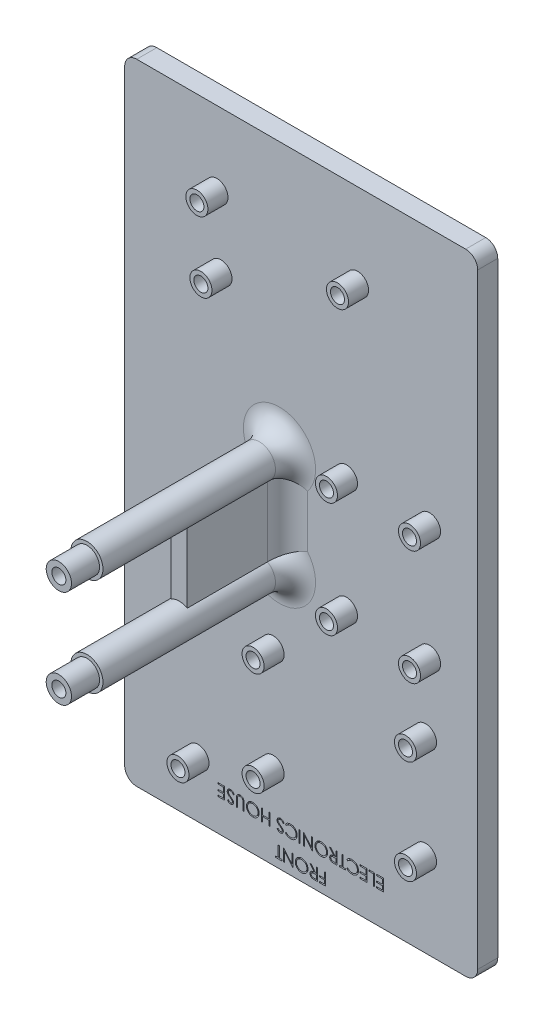
from build123d import *

# Parameters (mm, degrees)
SKETCH1_W           = 157
SKETCH1_H           = 88
BOSS_EXTRUDE1_DEPTH = 5
SKETCH2_R           = 2.75
BOSS_EXTRUDE2_DEPTH = 5
SKETCH3_R           = 1.75
CUT_EXTRUDE1_DEPTH  = 5
SKETCH4_R           = 4
BOSS_EXTRUDE3_DEPTH = 55
CUT_EXTRUDE2_START  = -7
SKETCH5_R           = 4
CUT_EXTRUDE2_DEPTH  = 7
SKETCH6_R           = 3.15
BOSS_EXTRUDE4_DEPTH = 7
SKETCH7_R           = 1.75
CUT_EXTRUDE3_DEPTH  = 5
BOSS_EXTRUDE5_DEPTH = 25
FILLET2_R           = 5
FILLET3_R           = 3
SKETCH12_W          = 0.269230769
SKETCH12_H          = 3
CUT_EXTRUDE7_DEPTH  = 1


with BuildPart() as part:
    # Sketch1 → Boss-Extrude1 (new body)
    with BuildSketch(Plane(origin=(0, 0, 0), x_dir=(0, 1, 0), z_dir=(0, 0, 1))):
        with Locations((78.5, 44)):
            Rectangle(SKETCH1_W, SKETCH1_H)
    extrude(amount=BOSS_EXTRUDE1_DEPTH)

    # Sketch2 → Boss-Extrude2 (add)
    with BuildSketch(Plane.XY.offset(5)):
        with Locations(Location((-65, 138.5, 0), (0, 0, 180))):
            Circle(SKETCH2_R)
        with Locations(Location((-29.95, 136, 0), (0, 0, 180))):
            Circle(SKETCH2_R)
        with Locations(Location((-64, 121.45, 0), (0, 0, 180))):
            Circle(SKETCH2_R)
        with Locations(Location((-32.7, 92.84, 0), (0, 0, 180))):
            Circle(SKETCH2_R)
        with Locations(Location((-12, 92.84, 0), (0, 0, 180))):
            Circle(SKETCH2_R)
        with Locations(Location((-12, 64.24, 0), (0, 0, 180))):
            Circle(SKETCH2_R)
        with Locations(Location((-32.7, 64.24, 0), (0, 0, 180))):
            Circle(SKETCH2_R)
        with Locations(Location((-51, 46.8, 0), (0, 0, 180))):
            Circle(SKETCH2_R)
        with Locations(Location((-13, 46.8, 0), (0, 0, 180))):
            Circle(SKETCH2_R)
        with Locations(Location((-13, 21, 0), (0, 0, 180))):
            Circle(SKETCH2_R)
        with Locations(Location((-51, 21, 0), (0, 0, 180))):
            Circle(SKETCH2_R)
        with Locations(Location((-69.72, 13.98, 0), (0, 0, 180))):
            Circle(SKETCH2_R)
        with Locations(Location((-66.72, 66.98, 0), (0, 0, 180))):
            Circle(SKETCH2_R)
    extrude(amount=BOSS_EXTRUDE2_DEPTH)

    # Sketch3 → Cut-Extrude1 (cut)
    with BuildSketch(Plane.XY.offset(5)):
        with Locations((-69.72, 13.98)):
            Circle(SKETCH3_R)
        with Locations((-51, 21)):
            Circle(SKETCH3_R)
        with Locations((-13, 21)):
            Circle(SKETCH3_R)
        with Locations((-13, 46.8)):
            Circle(SKETCH3_R)
        with Locations((-51, 46.8)):
            Circle(SKETCH3_R)
        with Locations((-32.7, 64.24)):
            Circle(SKETCH3_R)
        with Locations((-12, 64.24)):
            Circle(SKETCH3_R)
        with Locations((-32.7, 92.84)):
            Circle(SKETCH3_R)
        with Locations((-12, 92.84)):
            Circle(SKETCH3_R)
        with Locations((-64, 121.45)):
            Circle(SKETCH3_R)
        with Locations((-65, 138.5)):
            Circle(SKETCH3_R)
        with Locations((-29.95, 136)):
            Circle(SKETCH3_R)
        with Locations((-66.72, 66.98)):
            Circle(SKETCH3_R)
    extrude(amount=CUT_EXTRUDE1_DEPTH, mode=Mode.SUBTRACT)

    # Sketch4 → Boss-Extrude3 (add)
    with BuildSketch(Plane.XY.offset(5)):
        with Locations(Location((-49.410450416, 66.304857918, 0), (0, 0, 180))):
            Circle(SKETCH4_R)
        with Locations(Location((-49.410450416, 90.704857918, 0), (0, 0, 180))):
            Circle(SKETCH4_R)
    extrude(amount=BOSS_EXTRUDE3_DEPTH)

    # Sketch5 → Cut-Extrude2 (cut)
    with BuildSketch(Plane.XY.offset(60).offset(CUT_EXTRUDE2_START)):
        with Locations(Location((-49.410450416, 90.704857918, 0), (0, 0, 180))):
            Circle(SKETCH5_R)
        with Locations(Location((-49.410450416, 66.304857918, 0), (0, 0, 180))):
            Circle(SKETCH5_R)
    extrude(amount=CUT_EXTRUDE2_DEPTH, mode=Mode.SUBTRACT)

    # Sketch6 → Boss-Extrude4 (add)
    with BuildSketch(Plane.XY.offset(53)):
        with Locations((-49.410450416, 90.704857918)):
            Circle(SKETCH6_R)
        with Locations((-49.410450416, 66.304857918)):
            Circle(SKETCH6_R)
    extrude(amount=BOSS_EXTRUDE4_DEPTH)

    # Sketch7 → Cut-Extrude3 (cut)
    with BuildSketch(Plane.XY.offset(60)):
        with Locations((-49.410450416, 66.304857918)):
            Circle(SKETCH7_R)
        with Locations((-49.410450416, 90.704857918)):
            Circle(SKETCH7_R)
    extrude(amount=-CUT_EXTRUDE3_DEPTH, mode=Mode.SUBTRACT)

    # Sketch8 → Boss-Extrude5 (add)
    with BuildSketch(Plane.XY.offset(5)):
        Polygon((-49.410450416, 90.704857918), (-47.410450416, 90.704857918), (-47.410450416, 66.304857918), (-49.410450416, 66.304857918), (-51.410450416, 66.304857918), (-51.410450416, 90.704857918), align=None)
    extrude(amount=BOSS_EXTRUDE5_DEPTH)

    # Fillet2
    fillet2_edges = [part.edges().sort_by_distance(p)[0] for p in [
        (-47.410450416, 62.840756303, 5),
        (-47.410450416, 94.168959533, 5),
        (-47.410450416, 78.504857918, 5),
        (-51.410450416, 78.504857918, 5),
    ]]
    fillet(fillet2_edges, radius=FILLET2_R)

    # Fillet3
    fillet3_edges = [part.edges().sort_by_distance(p)[0] for p in [
        (-88, 0, 2.5),
        (-88, 157, 2.5),
        (0, 157, 2.5),
        (0, 0, 2.5),
    ]]
    fillet(fillet3_edges, radius=FILLET3_R)

    # Sketch12 → Cut-Extrude7 (cut)
    # profile 1 of 21: a face of its own
    with BuildSketch(Plane.XY.offset(5)):
        Polygon((-37.923076923, 2), (-39.384615385, 2), (-39.384615385, 2.307692308), (-38.192307692, 2.307692308), (-38.192307692, 3.230769231), (-39.384615385, 3.230769231), (-39.384615385, 3.538461538), (-38.192307692, 3.538461538), (-38.192307692, 5), (-37.923076923, 5), align=None)
    # profile 2 of 21: a face of its own
    with BuildSketch(Plane.XY.offset(5)):
        with BuildLine():
            Line((-39.923076923, 2), (-40.5234375, 2))
            add(Edge.make_bspline(
                [(-40.5234375, 2), (-40.563501324, 2.000133359), (-40.640428305, 2.000389424), (-40.750633966, 2.001817221), (-40.850771477, 2.005909526), (-40.940788483, 2.009431169), (-41.02068333, 2.015852833), (-41.090701007, 2.02199053), (-41.150519034, 2.030025097), (-41.186729764, 2.037486888), (-41.203125, 2.040865385)],
                knots=[0, 0, 0, 0, 1.410062039, 2.707475311, 3.878576406, 4.937260626, 5.877586885, 6.699081471, 7.410979367, 8, 8, 8, 8], degree=3))
            add(Edge.make_bspline(
                [(-41.203125, 2.040865385), (-41.225073905, 2.046287726), (-41.268503484, 2.057016735), (-41.33102675, 2.079705105), (-41.390630237, 2.105918357), (-41.447095673, 2.136941955), (-41.500408264, 2.172252027), (-41.550562637, 2.21199052), (-41.596886322, 2.256497911), (-41.641027443, 2.30393053), (-41.679571073, 2.356353534), (-41.714270565, 2.411106595), (-41.7433996, 2.469243846), (-41.7663209, 2.530472055), (-41.785536497, 2.594190605), (-41.798451172, 2.661029122), (-41.806494657, 2.730770147), (-41.807289354, 2.778222678), (-41.807692308, 2.802283654)],
                knots=[0, 0, 0, 0, 1.027276577, 2.032638556, 3.019345632, 3.985365262, 4.957888996, 5.923693931, 6.890056973, 7.876427719, 8.865527834, 9.843495157, 10.821038291, 11.815616373, 12.812734995, 13.843357168, 14.906466538, 16, 16, 16, 16], degree=3))
            add(Edge.make_bspline(
                [(-41.807692308, 2.802283654), (-41.806433199, 2.842256647), (-41.803976352, 2.920254309), (-41.781068664, 3.033448708), (-41.743547602, 3.139041898), (-41.691835776, 3.236886932), (-41.62601327, 3.325128092), (-41.546909585, 3.402371039), (-41.454928699, 3.467606228), (-41.36889851, 3.512363317), (-41.292867895, 3.541161946), (-41.230091035, 3.561526488), (-41.161560094, 3.576995325), (-41.088258253, 3.591054337), (-41.009619322, 3.601782492), (-40.925801658, 3.609401521), (-40.836595631, 3.614300615), (-40.775447264, 3.615016394), (-40.743990385, 3.615384615)],
                knots=[0, 0, 0, 0, 1.260402266, 2.459371274, 3.627181936, 4.786749125, 5.93865593, 7.087644312, 8.261344208, 9.485713728, 10.136162886, 10.825977872, 11.566646758, 12.35154167, 13.181268117, 14.0701832, 15.007234106, 16, 16, 16, 16], degree=3))
            Line((-40.743990385, 3.615384615), (-41.846153846, 5))
            Line((-41.846153846, 5), (-41.513221154, 5))
            Line((-41.513221154, 5), (-40.411057692, 3.615384615))
            Line((-40.411057692, 3.615384615), (-40.192307692, 3.615384615))
            Line((-40.192307692, 3.615384615), (-40.192307692, 5))
            Line((-40.192307692, 5), (-39.923076923, 5))
            Line((-39.923076923, 5), (-39.923076923, 2))
        make_face()
        with BuildLine():
            Line((-40.192307692, 2.307692308), (-40.192307692, 3.307692308))
            Line((-40.192307692, 3.307692308), (-40.741586538, 3.311899038))
            add(Edge.make_bspline(
                [(-40.741586538, 3.311899038), (-40.767232289, 3.311910391), (-40.816941059, 3.311932395), (-40.888855871, 3.30850907), (-40.955816115, 3.304615097), (-41.017564834, 3.298657514), (-41.074132389, 3.290984171), (-41.125481417, 3.281370882), (-41.171725391, 3.270218368), (-41.225487655, 3.252780552), (-41.286212221, 3.226344724), (-41.350845353, 3.185353674), (-41.407365175, 3.135781041), (-41.454355168, 3.078378592), (-41.492097583, 3.014994425), (-41.518313052, 2.947063018), (-41.535588894, 2.875654696), (-41.53749295, 2.826624311), (-41.538461538, 2.801682692)],
                knots=[0, 0, 0, 0, 1.146399208, 2.222048177, 3.218135709, 4.144938032, 4.994811973, 5.769438708, 6.479732432, 7.119818093, 8.294689872, 9.430121864, 10.527913442, 11.641375077, 12.733452768, 13.811150417, 14.886538365, 16, 16, 16, 16], degree=3))
            add(Edge.make_bspline(
                [(-41.538461538, 2.801682692), (-41.537443907, 2.77755234), (-41.535427333, 2.729734785), (-41.518588121, 2.659888671), (-41.491092355, 2.593474183), (-41.453457707, 2.531405229), (-41.406617353, 2.475480225), (-41.35205889, 2.427776116), (-41.291066199, 2.388144903), (-41.234522006, 2.361996131), (-41.18361232, 2.346610154), (-41.139613855, 2.335441489), (-41.089465908, 2.327619463), (-41.033758711, 2.320425288), (-40.972247548, 2.314332925), (-40.904894934, 2.310289114), (-40.831749026, 2.307872121), (-40.78105167, 2.307753641), (-40.754807692, 2.307692308)],
                knots=[0, 0, 0, 0, 1.100596872, 2.180981401, 3.259506136, 4.371595435, 5.481727359, 6.576991111, 7.667816242, 8.793363246, 9.406619729, 10.09427138, 10.864108636, 11.721733836, 12.6590937, 13.685439239, 14.801845161, 16, 16, 16, 16], degree=3))
            Line((-40.754807692, 2.307692308), (-40.192307692, 2.307692308))
        make_face(mode=Mode.SUBTRACT)
    # profile 3 of 21: a face of its own
    with BuildSketch(Plane.XY.offset(5)):
        with BuildLine():
            add(Edge.make_bspline(
                [(-43.865384615, 1.923076923), (-43.920940466, 1.924460232), (-44.03005674, 1.927177166), (-44.190275346, 1.948661086), (-44.343691114, 1.98402234), (-44.490395675, 2.033956593), (-44.629818461, 2.098702264), (-44.762400267, 2.177304961), (-44.887685372, 2.270537195), (-45.005349736, 2.376185793), (-45.112295266, 2.492315675), (-45.205355207, 2.616989285), (-45.284557895, 2.747697291), (-45.349269324, 2.88529091), (-45.400117327, 3.029155827), (-45.435185169, 3.180149078), (-45.457590834, 3.337267976), (-45.460209861, 3.444434015), (-45.461538462, 3.498798077)],
                knots=[0, 0, 0, 0, 1.065027606, 2.091802087, 3.093458616, 4.079833113, 5.057734272, 6.036020118, 7.030157768, 8.047461502, 9.064242947, 10.052216774, 11.02588392, 11.989864716, 12.962978571, 13.945936472, 14.957997893, 16, 16, 16, 16], degree=3))
            add(Edge.make_bspline(
                [(-45.461538462, 3.498798077), (-45.460209416, 3.552761369), (-45.457589712, 3.65912927), (-45.435166964, 3.815255565), (-45.399960942, 3.96532103), (-45.349898361, 4.108976633), (-45.285139266, 4.246292907), (-45.205811951, 4.377092365), (-45.112961088, 4.502129509), (-45.00645404, 4.618824704), (-44.890147473, 4.725780098), (-44.76624413, 4.820330275), (-44.634893524, 4.899095993), (-44.498145719, 4.964774801), (-44.354639768, 5.014517724), (-44.205387782, 5.050766295), (-44.049543491, 5.072946155), (-43.943382229, 5.07558289), (-43.889423077, 5.076923077)],
                knots=[0, 0, 0, 0, 1.043683505, 2.0572211, 3.045299494, 4.022276905, 4.994977706, 5.977452478, 6.97747046, 8.003698437, 9.029677512, 10.031249186, 11.013723958, 11.988083691, 12.9614021, 13.946617861, 14.956316495, 16, 16, 16, 16], degree=3))
            add(Edge.make_bspline(
                [(-43.889423077, 5.076923077), (-43.835059269, 5.075595209), (-43.727893731, 5.072977629), (-43.570577796, 5.050533869), (-43.419476998, 5.015450694), (-43.275056573, 4.965265467), (-43.137269128, 4.900651121), (-43.00612799, 4.821249686), (-42.881475572, 4.727685999), (-42.764580357, 4.621262592), (-42.657753932, 4.505179049), (-42.563793923, 4.381438394), (-42.484850254, 4.251217469), (-42.420208632, 4.115053071), (-42.36907957, 3.973297161), (-42.334186495, 3.825058041), (-42.311613698, 3.671166376), (-42.30901228, 3.56638684), (-42.307692308, 3.513221154)],
                knots=[0, 0, 0, 0, 1.053167129, 2.076072758, 3.073341244, 4.055601477, 5.033424535, 6.017524495, 7.021518915, 8.049444456, 9.077120685, 10.074910483, 11.055688766, 12.022980584, 12.991883888, 13.970269434, 14.970104079, 16, 16, 16, 16], degree=3))
            add(Edge.make_bspline(
                [(-42.307692308, 3.513221154), (-42.308150146, 3.477535846), (-42.309060048, 3.406615416), (-42.320030539, 3.301303587), (-42.335917396, 3.197674029), (-42.358804851, 3.096075095), (-42.388327725, 2.996490195), (-42.42470966, 2.899122984), (-42.466403371, 2.803171442), (-42.516045493, 2.710461699), (-42.570206535, 2.620848239), (-42.629263708, 2.535451605), (-42.693628788, 2.45579721), (-42.762382335, 2.380605136), (-42.836476051, 2.311158741), (-42.914794829, 2.245943934), (-42.997748468, 2.185635794), (-43.085468161, 2.131500958), (-43.175717461, 2.081777454), (-43.269151132, 2.04026242), (-43.363797817, 2.003568697), (-43.4604912, 1.974408069), (-43.559007615, 1.951201867), (-43.659470218, 1.93543384), (-43.761775533, 1.924438973), (-43.830699662, 1.923532893), (-43.865384615, 1.923076923)],
                knots=[0, 0, 0, 0, 1.037115869, 2.061148057, 3.07517727, 4.084041727, 5.086514338, 6.092668487, 7.104487461, 8.125783165, 9.147610153, 10.147694368, 11.141876323, 12.122903372, 13.107606018, 14.091946891, 15.084523921, 16.086505767, 17.087268121, 18.077809654, 19.05670789, 20.036870126, 21.011670792, 21.99694167, 22.991993299, 24, 24, 24, 24], degree=3))
        make_face()
        with BuildLine():
            add(Edge.make_bspline(
                [(-43.878605769, 2.230769231), (-43.850135654, 2.231114903), (-43.7934676, 2.231802943), (-43.70923006, 2.24092248), (-43.626070214, 2.253814324), (-43.544170765, 2.272585726), (-43.463458469, 2.296637826), (-43.383843737, 2.326338727), (-43.305255474, 2.361012516), (-43.228412329, 2.401260994), (-43.154541517, 2.446375359), (-43.083199177, 2.493940878), (-43.017109959, 2.546653502), (-42.954997329, 2.602558455), (-42.897011979, 2.662425469), (-42.843146163, 2.725813531), (-42.793452949, 2.793009612), (-42.748527988, 2.863733738), (-42.708548404, 2.937591963), (-42.672752974, 3.013172188), (-42.643079936, 3.091362704), (-42.619574466, 3.171675562), (-42.59962371, 3.253756845), (-42.587109118, 3.33805376), (-42.577902206, 3.424275706), (-42.577251966, 3.482546199), (-42.576923077, 3.512019231)],
                knots=[0, 0, 0, 0, 1.008431664, 2.007222653, 2.999229743, 3.989431819, 4.982149843, 5.98167215, 6.998687425, 8.024288174, 9.053028776, 10.065052016, 11.06063401, 12.045759335, 13.024701188, 14.011819507, 14.991481775, 15.984022113, 16.97831254, 17.965966747, 18.945551853, 19.938269878, 20.93007375, 21.936103907, 22.956087853, 24, 24, 24, 24], degree=3))
            add(Edge.make_bspline(
                [(-42.576923077, 3.512019231), (-42.578018316, 3.555357292), (-42.58017299, 3.640616665), (-42.598958093, 3.765574847), (-42.628123822, 3.885781868), (-42.670408619, 4.000521247), (-42.724351221, 4.110304639), (-42.790150245, 4.214704806), (-42.868408271, 4.313690952), (-42.957250231, 4.406526223), (-43.054396572, 4.49122692), (-43.157502247, 4.565679277), (-43.265751522, 4.628340458), (-43.378520477, 4.680723797), (-43.496771913, 4.720187225), (-43.619747648, 4.748324631), (-43.7474504, 4.766561284), (-43.834472424, 4.768332496), (-43.878605769, 4.769230769)],
                knots=[0, 0, 0, 0, 1.032022337, 2.030307203, 3.003823408, 3.974715386, 4.937372378, 5.913284036, 6.909147208, 7.938749767, 8.970518239, 9.975863271, 10.963918693, 11.946286286, 12.933361397, 13.927862637, 14.949112547, 16, 16, 16, 16], degree=3))
            add(Edge.make_bspline(
                [(-43.878605769, 4.769230769), (-43.908271174, 4.768823524), (-43.967106581, 4.768015835), (-44.054615306, 4.759869275), (-44.140555668, 4.746831538), (-44.224768603, 4.727966818), (-44.307365473, 4.704670283), (-44.388093246, 4.675768839), (-44.466939378, 4.641139654), (-44.544237807, 4.602484651), (-44.618314253, 4.558889057), (-44.688327494, 4.510988185), (-44.754737952, 4.460064616), (-44.81673721, 4.404564524), (-44.874480482, 4.345202517), (-44.927383594, 4.281546269), (-44.977053638, 4.21485357), (-45.021663502, 4.144147421), (-45.062191528, 4.070873611), (-45.096935417, 3.995073363), (-45.126625507, 3.917226768), (-45.150554453, 3.837257003), (-45.16931606, 3.755349206), (-45.182240989, 3.671384731), (-45.191282701, 3.585533976), (-45.19196417, 3.527467799), (-45.192307692, 3.498197115)],
                knots=[0, 0, 0, 0, 1.047362266, 2.077233941, 3.100744636, 4.115120168, 5.122788643, 6.129711893, 7.140355774, 8.162227187, 9.180148637, 10.17298275, 11.156396779, 12.133377858, 13.108923632, 14.078087502, 15.054351192, 16.043448276, 17.028082865, 18.009331763, 18.985518559, 19.968016174, 20.954783108, 21.950335389, 22.966780876, 24, 24, 24, 24], degree=3))
            add(Edge.make_bspline(
                [(-45.192307692, 3.498197115), (-45.191963881, 3.469126683), (-45.191281868, 3.411460126), (-45.182245462, 3.326207996), (-45.169301841, 3.2428481), (-45.150648091, 3.161707698), (-45.126605103, 3.082766104), (-45.096958817, 3.006097468), (-45.062000001, 2.93141614), (-45.02187862, 2.85890681), (-44.976779514, 2.789328211), (-44.927498097, 2.722812792), (-44.873187319, 2.660604097), (-44.815384693, 2.601187406), (-44.752700533, 2.545751127), (-44.685123846, 2.494509642), (-44.614337403, 2.445153469), (-44.538739661, 2.401474798), (-44.461002204, 2.360927742), (-44.381153124, 2.326363664), (-44.30019093, 2.296505898), (-44.218007485, 2.272689313), (-44.134744758, 2.253796089), (-44.050379611, 2.240927152), (-43.964943373, 2.231801963), (-43.907476297, 2.231114567), (-43.878605769, 2.230769231)],
                knots=[0, 0, 0, 0, 1.02988216, 2.042960975, 3.035124439, 4.018561492, 4.99104521, 5.957523397, 6.929462691, 7.91146347, 8.892205782, 9.866320947, 10.842813644, 11.816825305, 12.802668543, 13.805243666, 14.821427616, 15.858893029, 16.897256944, 17.927432741, 18.940436917, 19.95373962, 20.957947499, 21.96413624, 22.977215056, 24, 24, 24, 24], degree=3))
        make_face(mode=Mode.SUBTRACT)
    # profile 4 of 21: a face of its own
    with BuildSketch(Plane.XY.offset(5)):
        Polygon((-46.076923077, 5), (-46.076923077, 2), (-46.133413462, 2), (-48.115384615, 4.361177885), (-48.115384615, 2), (-48.384615385, 2), (-48.384615385, 5), (-48.323317308, 5), (-46.346153846, 2.644230769), (-46.346153846, 5), align=None)
    # profile 5 of 21: a face of its own
    with BuildSketch(Plane.XY.offset(5)):
        Polygon((-48.807692308, 2.307692308), (-48.807692308, 2), (-50.384615385, 2), (-50.384615385, 2.307692308), (-49.730769231, 2.307692308), (-49.730769231, 5), (-49.461538462, 5), (-49.461538462, 2.307692308), align=None)
    # profile 6 of 21: a face of its own
    with BuildSketch(Plane.XY.offset(5)):
        Polygon((-23.480769231, 7.961538462), (-25.173076923, 7.961538462), (-25.173076923, 8.269230769), (-23.75, 8.269230769), (-23.75, 9.192307692), (-25.173076923, 9.192307692), (-25.173076923, 9.5), (-23.75, 9.5), (-23.75, 10.653846154), (-25.173076923, 10.653846154), (-25.173076923, 10.961538462), (-23.480769231, 10.961538462), align=None)
    # profile 7 of 21: a face of its own
    with BuildSketch(Plane.XY.offset(5)):
        Polygon((-25.711538462, 7.961538462), (-25.980769231, 7.961538462), (-25.980769231, 10.653846154), (-27.134615385, 10.653846154), (-27.134615385, 10.961538462), (-25.711538462, 10.961538462), align=None)
    # profile 8 of 21: a face of its own
    with BuildSketch(Plane.XY.offset(5)):
        Polygon((-27.634615385, 7.961538462), (-29.326923077, 7.961538462), (-29.326923077, 8.269230769), (-27.903846154, 8.269230769), (-27.903846154, 9.192307692), (-29.326923077, 9.192307692), (-29.326923077, 9.5), (-27.903846154, 9.5), (-27.903846154, 10.653846154), (-29.326923077, 10.653846154), (-29.326923077, 10.961538462), (-27.634615385, 10.961538462), align=None)
    # profile 9 of 21: a face of its own
    with BuildSketch(Plane.XY.offset(5)):
        with BuildLine():
            Line((-32.634615385, 8.512019231), (-32.399038462, 8.692307692))
            add(Edge.make_bspline(
                [(-32.399038462, 8.692307692), (-32.382233242, 8.672279983), (-32.348849374, 8.632494582), (-32.295144018, 8.576622508), (-32.23916171, 8.524295417), (-32.180980342, 8.475177102), (-32.119253463, 8.431241728), (-32.056333041, 8.389067572), (-31.989932898, 8.352142647), (-31.898580444, 8.307034232), (-31.77860988, 8.260989939), (-31.628108587, 8.221387872), (-31.4707836, 8.19641572), (-31.363475473, 8.19369272), (-31.308894231, 8.192307692)],
                knots=[0, 0, 0, 0, 0.75789156, 1.505565099, 2.245254514, 2.979266606, 3.711207489, 4.440978832, 5.174393176, 5.91211879, 7.394186119, 8.890401545, 10.418332761, 12, 12, 12, 12], degree=3))
            add(Edge.make_bspline(
                [(-31.308894231, 8.192307692), (-31.278823197, 8.192655508), (-31.218960217, 8.193347912), (-31.130113273, 8.202418391), (-31.042757102, 8.215313879), (-30.95721655, 8.233982776), (-30.87366146, 8.258287985), (-30.791455635, 8.286791511), (-30.711567219, 8.322261243), (-30.633034858, 8.361432877), (-30.557798814, 8.405689436), (-30.486598394, 8.453947327), (-30.419754718, 8.505729821), (-30.357097794, 8.560914548), (-30.299258983, 8.620145751), (-30.245623841, 8.682757933), (-30.196260825, 8.749033854), (-30.151220867, 8.818656845), (-30.110935465, 8.891282989), (-30.076001477, 8.966600325), (-30.046472002, 9.04432112), (-30.022515828, 9.12427881), (-30.003766748, 9.206190364), (-29.990788391, 9.29034907), (-29.981801479, 9.376607823), (-29.981115176, 9.435072769), (-29.980769231, 9.464543269)],
                knots=[0, 0, 0, 0, 1.054960097, 2.100129169, 3.131228542, 4.15308236, 5.169990287, 6.183953224, 7.204064171, 8.235355279, 9.262684623, 10.264978336, 11.252191258, 12.228402777, 13.192898315, 14.155264692, 15.119862721, 16.091023151, 17.063429752, 18.032246104, 19.00241354, 19.978852882, 20.959535218, 21.948948728, 22.966123959, 24, 24, 24, 24], degree=3))
            add(Edge.make_bspline(
                [(-29.980769231, 9.464543269), (-29.981853326, 9.508883412), (-29.983981803, 9.595939401), (-30.002844374, 9.723471099), (-30.031738138, 9.845763835), (-30.07433303, 9.961989575), (-30.127902865, 10.073117203), (-30.194743249, 10.177799067), (-30.272449116, 10.277568789), (-30.361817628, 10.370010003), (-30.459882349, 10.454449145), (-30.565094158, 10.528807103), (-30.677195158, 10.590791204), (-30.794946506, 10.642370609), (-30.919254617, 10.682019227), (-31.049895873, 10.709931334), (-31.186586155, 10.728138917), (-31.279988498, 10.729882078), (-31.327524038, 10.730769231)],
                knots=[0, 0, 0, 0, 1.029159485, 2.020618137, 2.987588728, 3.942669054, 4.889339625, 5.846988364, 6.821327795, 7.821533711, 8.827683044, 9.822769455, 10.807800696, 11.797391277, 12.803701919, 13.832062008, 14.896664671, 16, 16, 16, 16], degree=3))
            add(Edge.make_bspline(
                [(-31.327524038, 10.730769231), (-31.379897772, 10.729321705), (-31.482981808, 10.726472629), (-31.634154402, 10.70233613), (-31.778870773, 10.663200771), (-31.917138704, 10.608431124), (-32.048568401, 10.537232306), (-32.173365538, 10.450919839), (-32.291635456, 10.348672697), (-32.362753698, 10.270601444), (-32.399038462, 10.230769231)],
                knots=[0, 0, 0, 0, 1.028121516, 2.023589091, 2.998037872, 3.967518031, 4.937445131, 5.927275754, 6.942489185, 8, 8, 8, 8], degree=3))
            Line((-32.399038462, 10.230769231), (-32.634615385, 10.409254808))
            add(Edge.make_bspline(
                [(-32.634615385, 10.409254808), (-32.615656365, 10.433715533), (-32.577829139, 10.482519819), (-32.516588896, 10.551336077), (-32.452030061, 10.616009233), (-32.383978352, 10.676202473), (-32.312344932, 10.732216663), (-32.237161111, 10.783791349), (-32.158801879, 10.831498649), (-32.077169118, 10.874739711), (-31.992258359, 10.913217034), (-31.90479727, 10.946846126), (-31.814625637, 10.975084234), (-31.722454538, 10.99881009), (-31.627336916, 11.015754884), (-31.530361082, 11.029240346), (-31.430624132, 11.037242703), (-31.363395567, 11.038051615), (-31.329326923, 11.038461538)],
                knots=[0, 0, 0, 0, 0.986880684, 1.969034265, 2.935876267, 3.899990983, 4.864973347, 5.834408638, 6.8063673, 7.789580233, 8.778939794, 9.778051223, 10.776304221, 11.791326552, 12.811423977, 13.855999788, 14.91350973, 16, 16, 16, 16], degree=3))
            add(Edge.make_bspline(
                [(-31.329326923, 11.038461538), (-31.297060923, 11.038236973), (-31.233258903, 11.037792924), (-31.139059973, 11.030599637), (-31.047354618, 11.020785577), (-30.958404938, 11.006008322), (-30.871725531, 10.988570316), (-30.788102173, 10.965194953), (-30.706711993, 10.939009954), (-30.627881986, 10.908234251), (-30.551545101, 10.873506094), (-30.477947548, 10.834256187), (-30.407123178, 10.790814588), (-30.338375674, 10.744138865), (-30.272720602, 10.692729749), (-30.209589009, 10.637301205), (-30.148626887, 10.578040053), (-30.1109103, 10.535307322), (-30.091947115, 10.513822115)],
                knots=[0, 0, 0, 0, 1.114604814, 2.203992996, 3.262667896, 4.300477797, 5.318619304, 6.316056647, 7.298880507, 8.271930387, 9.238335007, 10.195173496, 11.151986948, 12.108099108, 13.064862484, 14.031167946, 15.010108607, 16, 16, 16, 16], degree=3))
            add(Edge.make_bspline(
                [(-30.091947115, 10.513822115), (-30.061575688, 10.476500326), (-30.001199503, 10.40230733), (-29.923919749, 10.282073539), (-29.857989252, 10.156651057), (-29.804086951, 10.025313416), (-29.762683696, 9.888009558), (-29.733574516, 9.744960366), (-29.714790406, 9.596451801), (-29.712634382, 9.495450263), (-29.711538462, 9.444110577)],
                knots=[0, 0, 0, 0, 0.994611881, 1.977215934, 2.950189954, 3.921972279, 4.908960509, 5.911694611, 6.938501887, 8, 8, 8, 8], degree=3))
            add(Edge.make_bspline(
                [(-29.711538462, 9.444110577), (-29.712877447, 9.390151017), (-29.715511817, 9.283988952), (-29.73770883, 9.128150484), (-29.773849855, 8.979061055), (-29.823616288, 8.836147004), (-29.88927152, 8.700226032), (-29.968752487, 8.570724086), (-30.062835526, 8.44774691), (-30.170339046, 8.332866777), (-30.288260117, 8.227835845), (-30.414531762, 8.135429796), (-30.548916716, 8.058529261), (-30.689931902, 7.994246784), (-30.838633946, 7.944837258), (-30.994705397, 7.910248809), (-31.157853041, 7.888719853), (-31.269163691, 7.885998246), (-31.325721154, 7.884615385)],
                knots=[0, 0, 0, 0, 1.032901378, 2.032168977, 3.007206631, 3.966850309, 4.924221947, 5.891988639, 6.871730993, 7.884084801, 8.900290346, 9.89161143, 10.874607481, 11.860025555, 12.854717796, 13.869097222, 14.917278314, 16, 16, 16, 16], degree=3))
            add(Edge.make_bspline(
                [(-31.325721154, 7.884615385), (-31.360190656, 7.885028697), (-31.428419563, 7.885846806), (-31.529351069, 7.893822764), (-31.627613491, 7.907122845), (-31.723480183, 7.925248647), (-31.817109271, 7.94779366), (-31.908079979, 7.976022994), (-31.99613165, 8.010154126), (-32.081858018, 8.04814123), (-32.164159928, 8.09164672), (-32.24299644, 8.138935231), (-32.317727417, 8.190917381), (-32.388838647, 8.246835026), (-32.456001361, 8.307118334), (-32.520223533, 8.370754021), (-32.579598264, 8.439430147), (-32.616242774, 8.487778577), (-32.634615385, 8.512019231)],
                knots=[0, 0, 0, 0, 1.096566765, 2.170543479, 3.218870886, 4.250164525, 5.273529809, 6.281496242, 7.278154839, 8.276706968, 9.263143576, 10.238168486, 11.199979644, 12.157579042, 13.114563119, 14.070017788, 15.032356758, 16, 16, 16, 16], degree=3))
        make_face()
    # profile 10 of 21: a face of its own
    with BuildSketch(Plane.XY.offset(5)):
        Polygon((-32.903846154, 8.269230769), (-32.903846154, 7.961538462), (-34.480769231, 7.961538462), (-34.480769231, 8.269230769), (-33.826923077, 8.269230769), (-33.826923077, 10.961538462), (-33.557692308, 10.961538462), (-33.557692308, 8.269230769), align=None)
    # profile 11 of 21: a face of its own
    with BuildSketch(Plane.XY.offset(5)):
        with BuildLine():
            Line((-35.019230769, 7.961538462), (-35.619591346, 7.961538462))
            add(Edge.make_bspline(
                [(-35.619591346, 7.961538462), (-35.659655171, 7.961671821), (-35.736582152, 7.961927886), (-35.846787812, 7.963355683), (-35.946925324, 7.967447987), (-36.036942329, 7.97096963), (-36.116837176, 7.977391294), (-36.186854854, 7.983528992), (-36.24667288, 7.991563558), (-36.28288361, 7.999025349), (-36.299278846, 8.002403846)],
                knots=[0, 0, 0, 0, 1.410062039, 2.707475311, 3.878576406, 4.937260626, 5.877586885, 6.699081471, 7.410979367, 8, 8, 8, 8], degree=3))
            add(Edge.make_bspline(
                [(-36.299278846, 8.002403846), (-36.321227751, 8.007826187), (-36.36465733, 8.018555197), (-36.427180597, 8.041243566), (-36.486784083, 8.067456819), (-36.543249519, 8.098480417), (-36.59656211, 8.133790489), (-36.646716483, 8.173528981), (-36.693040168, 8.218036372), (-36.737181289, 8.265468991), (-36.775724919, 8.317891995), (-36.810424412, 8.372645056), (-36.839553446, 8.430782307), (-36.862474746, 8.492010516), (-36.881690343, 8.555729067), (-36.894605018, 8.622567584), (-36.902648503, 8.692308609), (-36.9034432, 8.73976114), (-36.903846154, 8.763822115)],
                knots=[0, 0, 0, 0, 1.027276577, 2.032638556, 3.019345632, 3.985365262, 4.957888996, 5.923693931, 6.890056973, 7.876427719, 8.865527834, 9.843495157, 10.821038291, 11.815616373, 12.812734995, 13.843357168, 14.906466538, 16, 16, 16, 16], degree=3))
            add(Edge.make_bspline(
                [(-36.903846154, 8.763822115), (-36.902587045, 8.803795108), (-36.900130198, 8.88179277), (-36.87722251, 8.994987169), (-36.839701448, 9.10058036), (-36.787989622, 9.198425393), (-36.722167116, 9.286666553), (-36.643063432, 9.363909501), (-36.551082545, 9.429144689), (-36.465052356, 9.473901778), (-36.389021741, 9.502700407), (-36.326244881, 9.523064949), (-36.25771394, 9.538533787), (-36.1844121, 9.552592798), (-36.105773168, 9.563320954), (-36.021955504, 9.570939983), (-35.932749477, 9.575839077), (-35.87160111, 9.576554855), (-35.840144231, 9.576923077)],
                knots=[0, 0, 0, 0, 1.260402266, 2.459371274, 3.627181936, 4.786749125, 5.93865593, 7.087644312, 8.261344208, 9.485713728, 10.136162886, 10.825977872, 11.566646758, 12.35154167, 13.181268117, 14.0701832, 15.007234106, 16, 16, 16, 16], degree=3))
            Line((-35.840144231, 9.576923077), (-36.942307692, 10.961538462))
            Line((-36.942307692, 10.961538462), (-36.609375, 10.961538462))
            Line((-36.609375, 10.961538462), (-35.507211538, 9.576923077))
            Line((-35.507211538, 9.576923077), (-35.288461538, 9.576923077))
            Line((-35.288461538, 9.576923077), (-35.288461538, 10.961538462))
            Line((-35.288461538, 10.961538462), (-35.019230769, 10.961538462))
            Line((-35.019230769, 10.961538462), (-35.019230769, 7.961538462))
        make_face()
        with BuildLine():
            Line((-35.288461538, 8.269230769), (-35.288461538, 9.269230769))
            Line((-35.288461538, 9.269230769), (-35.837740385, 9.2734375))
            add(Edge.make_bspline(
                [(-35.837740385, 9.2734375), (-35.863386136, 9.273448852), (-35.913094905, 9.273470856), (-35.985009717, 9.270047531), (-36.051969961, 9.266153558), (-36.113718681, 9.260195975), (-36.170286236, 9.252522632), (-36.221635263, 9.242909343), (-36.267879237, 9.23175683), (-36.321641501, 9.214319014), (-36.382366067, 9.187883185), (-36.446999199, 9.146892135), (-36.503519021, 9.097319502), (-36.550509014, 9.039917053), (-36.588251429, 8.976532887), (-36.614466898, 8.908601479), (-36.63174274, 8.837193158), (-36.633646796, 8.788162773), (-36.634615385, 8.763221154)],
                knots=[0, 0, 0, 0, 1.146399208, 2.222048177, 3.218135709, 4.144938032, 4.994811973, 5.769438708, 6.479732432, 7.119818093, 8.294689872, 9.430121864, 10.527913442, 11.641375077, 12.733452768, 13.811150417, 14.886538365, 16, 16, 16, 16], degree=3))
            add(Edge.make_bspline(
                [(-36.634615385, 8.763221154), (-36.633597753, 8.739090801), (-36.631581179, 8.691273247), (-36.614741967, 8.621427133), (-36.587246201, 8.555012645), (-36.549611554, 8.492943691), (-36.502771199, 8.437018687), (-36.448212736, 8.389314578), (-36.387220045, 8.349683364), (-36.330675853, 8.323534593), (-36.279766166, 8.308148615), (-36.235767702, 8.296979951), (-36.185619754, 8.289157925), (-36.129912557, 8.28196375), (-36.068401394, 8.275871386), (-36.00104878, 8.271827575), (-35.927902872, 8.269410583), (-35.877205517, 8.269292102), (-35.850961538, 8.269230769)],
                knots=[0, 0, 0, 0, 1.100596872, 2.180981401, 3.259506136, 4.371595435, 5.481727359, 6.576991111, 7.667816242, 8.793363246, 9.406619729, 10.09427138, 10.864108636, 11.721733836, 12.6590937, 13.685439239, 14.801845161, 16, 16, 16, 16], degree=3))
            Line((-35.850961538, 8.269230769), (-35.288461538, 8.269230769))
        make_face(mode=Mode.SUBTRACT)
    # profile 12 of 21: a face of its own
    with BuildSketch(Plane.XY.offset(5)):
        with BuildLine():
            add(Edge.make_bspline(
                [(-38.961538462, 7.884615385), (-39.017094312, 7.885998694), (-39.126210586, 7.888715627), (-39.286429192, 7.910199548), (-39.43984496, 7.945560802), (-39.586549521, 7.995495055), (-39.725972307, 8.060240726), (-39.858554113, 8.138843423), (-39.983839218, 8.232075656), (-40.101503583, 8.337724254), (-40.208449112, 8.453854137), (-40.301509053, 8.578527746), (-40.380711741, 8.709235753), (-40.44542317, 8.846829371), (-40.496271173, 8.990694289), (-40.531339015, 9.141687539), (-40.55374468, 9.298806438), (-40.556363707, 9.405972476), (-40.557692308, 9.460336538)],
                knots=[0, 0, 0, 0, 1.065027606, 2.091802087, 3.093458616, 4.079833113, 5.057734272, 6.036020118, 7.030157768, 8.047461502, 9.064242947, 10.052216774, 11.02588392, 11.989864716, 12.962978571, 13.945936472, 14.957997893, 16, 16, 16, 16], degree=3))
            add(Edge.make_bspline(
                [(-40.557692308, 9.460336538), (-40.556363262, 9.514299831), (-40.553743558, 9.620667731), (-40.53132081, 9.776794027), (-40.496114788, 9.926859492), (-40.446052207, 10.070515094), (-40.381293112, 10.207831368), (-40.301965797, 10.338630827), (-40.209114934, 10.46366797), (-40.102607886, 10.580363165), (-39.986301319, 10.687318559), (-39.862397976, 10.781868736), (-39.731047371, 10.860634455), (-39.594299565, 10.926313263), (-39.450793614, 10.976056186), (-39.301541628, 11.012304756), (-39.145697337, 11.034484617), (-39.039536075, 11.037121351), (-38.985576923, 11.038461538)],
                knots=[0, 0, 0, 0, 1.043683505, 2.0572211, 3.045299494, 4.022276905, 4.994977706, 5.977452478, 6.97747046, 8.003698437, 9.029677512, 10.031249186, 11.013723958, 11.988083691, 12.9614021, 13.946617861, 14.956316495, 16, 16, 16, 16], degree=3))
            add(Edge.make_bspline(
                [(-38.985576923, 11.038461538), (-38.931213115, 11.037133671), (-38.824047577, 11.03451609), (-38.666731643, 11.012072331), (-38.515630844, 10.976989156), (-38.371210419, 10.926803928), (-38.233422974, 10.862189583), (-38.102281836, 10.782788147), (-37.977629418, 10.689224461), (-37.860734203, 10.582801053), (-37.753907779, 10.466717511), (-37.65994777, 10.342976855), (-37.5810041, 10.212755931), (-37.516362478, 10.076591533), (-37.465233416, 9.934835622), (-37.430340341, 9.786596502), (-37.407767544, 9.632704838), (-37.405166127, 9.527925301), (-37.403846154, 9.474759615)],
                knots=[0, 0, 0, 0, 1.053167129, 2.076072758, 3.073341244, 4.055601477, 5.033424535, 6.017524495, 7.021518915, 8.049444456, 9.077120685, 10.074910483, 11.055688766, 12.022980584, 12.991883888, 13.970269434, 14.970104079, 16, 16, 16, 16], degree=3))
            add(Edge.make_bspline(
                [(-37.403846154, 9.474759615), (-37.404303993, 9.439074307), (-37.405213894, 9.368153877), (-37.416184385, 9.262842048), (-37.432071242, 9.159212491), (-37.454958697, 9.057613557), (-37.484481572, 8.958028656), (-37.520863506, 8.860661445), (-37.562557217, 8.764709904), (-37.61219934, 8.672000161), (-37.666360381, 8.582386701), (-37.725417554, 8.496990066), (-37.789782634, 8.417335671), (-37.858536181, 8.342143597), (-37.932629898, 8.272697203), (-38.010948675, 8.207482395), (-38.093902314, 8.147174256), (-38.181622007, 8.09303942), (-38.271871308, 8.043315916), (-38.365304978, 8.001800882), (-38.459951663, 7.965107159), (-38.556645047, 7.935946531), (-38.655161462, 7.912740329), (-38.755624064, 7.896972301), (-38.857929379, 7.885977434), (-38.926853508, 7.885071355), (-38.961538462, 7.884615385)],
                knots=[0, 0, 0, 0, 1.037115869, 2.061148057, 3.07517727, 4.084041727, 5.086514338, 6.092668487, 7.104487461, 8.125783165, 9.147610153, 10.147694368, 11.141876323, 12.122903372, 13.107606018, 14.091946891, 15.084523921, 16.086505767, 17.087268121, 18.077809654, 19.05670789, 20.036870126, 21.011670792, 21.99694167, 22.991993299, 24, 24, 24, 24], degree=3))
        make_face()
        with BuildLine():
            add(Edge.make_bspline(
                [(-38.974759615, 8.192307692), (-38.9462895, 8.192653365), (-38.889621446, 8.193341404), (-38.805383906, 8.202460942), (-38.72222406, 8.215352785), (-38.640324611, 8.234124188), (-38.559612315, 8.258176288), (-38.479997583, 8.287877188), (-38.40140932, 8.322550978), (-38.324566175, 8.362799455), (-38.250695363, 8.40791382), (-38.179353023, 8.45547934), (-38.113263805, 8.508191963), (-38.051151175, 8.564096916), (-37.993165825, 8.623963931), (-37.939300009, 8.687351992), (-37.889606795, 8.754548073), (-37.844681834, 8.825272199), (-37.804702251, 8.899130424), (-37.76890682, 8.974710649), (-37.739233782, 9.052901166), (-37.715728313, 9.133214023), (-37.695777556, 9.215295306), (-37.683262964, 9.299592221), (-37.674056052, 9.385814168), (-37.673405812, 9.444084661), (-37.673076923, 9.473557692)],
                knots=[0, 0, 0, 0, 1.008431664, 2.007222653, 2.999229743, 3.989431819, 4.982149843, 5.98167215, 6.998687425, 8.024288174, 9.053028776, 10.065052016, 11.06063401, 12.045759335, 13.024701188, 14.011819507, 14.991481775, 15.984022113, 16.97831254, 17.965966747, 18.945551853, 19.938269878, 20.93007375, 21.936103907, 22.956087853, 24, 24, 24, 24], degree=3))
            add(Edge.make_bspline(
                [(-37.673076923, 9.473557692), (-37.674172162, 9.516895753), (-37.676326836, 9.602155127), (-37.695111939, 9.727113308), (-37.724277668, 9.847320329), (-37.766562465, 9.962059709), (-37.820505067, 10.0718431), (-37.886304091, 10.176243268), (-37.964562117, 10.275229413), (-38.053404077, 10.368064684), (-38.150550418, 10.452765381), (-38.253656093, 10.527217739), (-38.361905368, 10.58987892), (-38.474674324, 10.642262258), (-38.59292576, 10.681725687), (-38.715901495, 10.709863093), (-38.843604246, 10.728099745), (-38.93062627, 10.729870958), (-38.974759615, 10.730769231)],
                knots=[0, 0, 0, 0, 1.032022337, 2.030307203, 3.003823408, 3.974715386, 4.937372378, 5.913284036, 6.909147208, 7.938749767, 8.970518239, 9.975863271, 10.963918693, 11.946286286, 12.933361397, 13.927862637, 14.949112547, 16, 16, 16, 16], degree=3))
            add(Edge.make_bspline(
                [(-38.974759615, 10.730769231), (-39.00442502, 10.730361986), (-39.063260427, 10.729554296), (-39.150769152, 10.721407737), (-39.236709514, 10.708369999), (-39.320922449, 10.689505279), (-39.403519319, 10.666208745), (-39.484247092, 10.637307301), (-39.563093224, 10.602678115), (-39.640391653, 10.564023113), (-39.714468099, 10.520427519), (-39.78448134, 10.472526647), (-39.850891798, 10.421603078), (-39.912891056, 10.366102985), (-39.970634328, 10.306740978), (-40.02353744, 10.243084731), (-40.073207484, 10.176392032), (-40.117817349, 10.105685883), (-40.158345374, 10.032412073), (-40.193089264, 9.956611824), (-40.222779353, 9.878765229), (-40.246708299, 9.798795465), (-40.265469906, 9.716887667), (-40.278394835, 9.632923193), (-40.287436547, 9.547072438), (-40.288118016, 9.489006261), (-40.288461538, 9.459735577)],
                knots=[0, 0, 0, 0, 1.047362266, 2.077233941, 3.100744636, 4.115120168, 5.122788643, 6.129711893, 7.140355774, 8.162227187, 9.180148637, 10.17298275, 11.156396779, 12.133377858, 13.108923632, 14.078087502, 15.054351192, 16.043448276, 17.028082865, 18.009331763, 18.985518559, 19.968016174, 20.954783108, 21.950335389, 22.966780876, 24, 24, 24, 24], degree=3))
            add(Edge.make_bspline(
                [(-40.288461538, 9.459735577), (-40.288117727, 9.430665145), (-40.287435715, 9.372998587), (-40.278399308, 9.287746457), (-40.265455688, 9.204386562), (-40.246801938, 9.12324616), (-40.22275895, 9.044304565), (-40.193112663, 8.967635929), (-40.158153847, 8.892954601), (-40.118032466, 8.820445271), (-40.07293336, 8.750866673), (-40.023651944, 8.684351254), (-39.969341165, 8.622142558), (-39.911538539, 8.562725867), (-39.848854379, 8.507289589), (-39.781277693, 8.456048104), (-39.710491249, 8.40669193), (-39.634893507, 8.363013259), (-39.55715605, 8.322466203), (-39.47730697, 8.287902125), (-39.396344776, 8.25804436), (-39.314161331, 8.234227775), (-39.230898604, 8.21533455), (-39.146533458, 8.202465613), (-39.061097219, 8.193340425), (-39.003630143, 8.192653029), (-38.974759615, 8.192307692)],
                knots=[0, 0, 0, 0, 1.02988216, 2.042960975, 3.035124439, 4.018561492, 4.99104521, 5.957523397, 6.929462691, 7.91146347, 8.892205782, 9.866320947, 10.842813644, 11.816825305, 12.802668543, 13.805243666, 14.821427616, 15.858893029, 16.897256944, 17.927432741, 18.940436917, 19.95373962, 20.957947499, 21.96413624, 22.977215056, 24, 24, 24, 24], degree=3))
        make_face(mode=Mode.SUBTRACT)
    # profile 13 of 21: a face of its own
    with BuildSketch(Plane.XY.offset(5)):
        Polygon((-41.173076923, 10.961538462), (-41.173076923, 7.961538462), (-41.229567308, 7.961538462), (-43.211538462, 10.322716346), (-43.211538462, 7.961538462), (-43.480769231, 7.961538462), (-43.480769231, 10.961538462), (-43.419471154, 10.961538462), (-41.442307692, 8.605769231), (-41.442307692, 10.961538462), align=None)
    # profile 14 of 21: a face of its own
    with BuildSketch(Plane.XY.offset(5)):
        with Locations((-44.384615385, 9.461538462)):
            Rectangle(SKETCH12_W, SKETCH12_H)
    # profile 15 of 21: a face of its own
    with BuildSketch(Plane.XY.offset(5)):
        with BuildLine():
            Line((-47.942307692, 8.512019231), (-47.706730769, 8.692307692))
            add(Edge.make_bspline(
                [(-47.706730769, 8.692307692), (-47.68992555, 8.672279983), (-47.656541682, 8.632494582), (-47.602836326, 8.576622508), (-47.546854018, 8.524295417), (-47.48867265, 8.475177102), (-47.426945771, 8.431241728), (-47.364025349, 8.389067572), (-47.297625206, 8.352142647), (-47.206272751, 8.307034232), (-47.086302188, 8.260989939), (-46.935800895, 8.221387872), (-46.778475907, 8.19641572), (-46.671167781, 8.19369272), (-46.616586538, 8.192307692)],
                knots=[0, 0, 0, 0, 0.75789156, 1.505565099, 2.245254514, 2.979266606, 3.711207489, 4.440978832, 5.174393176, 5.91211879, 7.394186119, 8.890401545, 10.418332761, 12, 12, 12, 12], degree=3))
            add(Edge.make_bspline(
                [(-46.616586538, 8.192307692), (-46.586515505, 8.192655508), (-46.526652524, 8.193347912), (-46.437805581, 8.202418391), (-46.35044941, 8.215313879), (-46.264908858, 8.233982776), (-46.181353768, 8.258287985), (-46.099147943, 8.286791511), (-46.019259526, 8.322261243), (-45.940727166, 8.361432877), (-45.865491122, 8.405689436), (-45.794290701, 8.453947327), (-45.727447026, 8.505729821), (-45.664790101, 8.560914548), (-45.606951291, 8.620145751), (-45.553316149, 8.682757933), (-45.503953133, 8.749033854), (-45.458913175, 8.818656845), (-45.418627773, 8.891282989), (-45.383693785, 8.966600325), (-45.35416431, 9.04432112), (-45.330208136, 9.12427881), (-45.311459055, 9.206190364), (-45.298480699, 9.29034907), (-45.289493787, 9.376607823), (-45.288807484, 9.435072769), (-45.288461538, 9.464543269)],
                knots=[0, 0, 0, 0, 1.054960097, 2.100129169, 3.131228542, 4.15308236, 5.169990287, 6.183953224, 7.204064171, 8.235355279, 9.262684623, 10.264978336, 11.252191258, 12.228402777, 13.192898315, 14.155264692, 15.119862721, 16.091023151, 17.063429752, 18.032246104, 19.00241354, 19.978852882, 20.959535218, 21.948948728, 22.966123959, 24, 24, 24, 24], degree=3))
            add(Edge.make_bspline(
                [(-45.288461538, 9.464543269), (-45.289545634, 9.508883412), (-45.291674111, 9.595939401), (-45.310536682, 9.723471099), (-45.339430445, 9.845763835), (-45.382025338, 9.961989575), (-45.435595173, 10.073117203), (-45.502435557, 10.177799067), (-45.580141423, 10.277568789), (-45.669509936, 10.370010003), (-45.767574657, 10.454449145), (-45.872786465, 10.528807103), (-45.984887465, 10.590791204), (-46.102638814, 10.642370609), (-46.226946925, 10.682019227), (-46.35758818, 10.709931334), (-46.494278463, 10.728138917), (-46.587680806, 10.729882078), (-46.635216346, 10.730769231)],
                knots=[0, 0, 0, 0, 1.029159485, 2.020618137, 2.987588728, 3.942669054, 4.889339625, 5.846988364, 6.821327795, 7.821533711, 8.827683044, 9.822769455, 10.807800696, 11.797391277, 12.803701919, 13.832062008, 14.896664671, 16, 16, 16, 16], degree=3))
            add(Edge.make_bspline(
                [(-46.635216346, 10.730769231), (-46.68759008, 10.729321705), (-46.790674116, 10.726472629), (-46.94184671, 10.70233613), (-47.08656308, 10.663200771), (-47.224831012, 10.608431124), (-47.356260708, 10.537232306), (-47.481057846, 10.450919839), (-47.599327763, 10.348672697), (-47.670446005, 10.270601444), (-47.706730769, 10.230769231)],
                knots=[0, 0, 0, 0, 1.028121516, 2.023589091, 2.998037872, 3.967518031, 4.937445131, 5.927275754, 6.942489185, 8, 8, 8, 8], degree=3))
            Line((-47.706730769, 10.230769231), (-47.942307692, 10.409254808))
            add(Edge.make_bspline(
                [(-47.942307692, 10.409254808), (-47.923348673, 10.433715533), (-47.885521446, 10.482519819), (-47.824281204, 10.551336077), (-47.759722368, 10.616009233), (-47.691670659, 10.676202473), (-47.62003724, 10.732216663), (-47.544853419, 10.783791349), (-47.466494187, 10.831498649), (-47.384861426, 10.874739711), (-47.299950667, 10.913217034), (-47.212489578, 10.946846126), (-47.122317945, 10.975084234), (-47.030146846, 10.99881009), (-46.935029224, 11.015754884), (-46.83805339, 11.029240346), (-46.738316439, 11.037242703), (-46.671087875, 11.038051615), (-46.637019231, 11.038461538)],
                knots=[0, 0, 0, 0, 0.986880684, 1.969034265, 2.935876267, 3.899990983, 4.864973347, 5.834408638, 6.8063673, 7.789580233, 8.778939794, 9.778051223, 10.776304221, 11.791326552, 12.811423977, 13.855999788, 14.91350973, 16, 16, 16, 16], degree=3))
            add(Edge.make_bspline(
                [(-46.637019231, 11.038461538), (-46.60475323, 11.038236973), (-46.54095121, 11.037792924), (-46.44675228, 11.030599637), (-46.355046925, 11.020785577), (-46.266097246, 11.006008322), (-46.179417839, 10.988570316), (-46.095794481, 10.965194953), (-46.0144043, 10.939009954), (-45.935574294, 10.908234251), (-45.859237409, 10.873506094), (-45.785639856, 10.834256187), (-45.714815485, 10.790814588), (-45.646067982, 10.744138865), (-45.58041291, 10.692729749), (-45.517281317, 10.637301205), (-45.456319194, 10.578040053), (-45.418602607, 10.535307322), (-45.399639423, 10.513822115)],
                knots=[0, 0, 0, 0, 1.114604814, 2.203992996, 3.262667896, 4.300477797, 5.318619304, 6.316056647, 7.298880507, 8.271930387, 9.238335007, 10.195173496, 11.151986948, 12.108099108, 13.064862484, 14.031167946, 15.010108607, 16, 16, 16, 16], degree=3))
            add(Edge.make_bspline(
                [(-45.399639423, 10.513822115), (-45.369267995, 10.476500326), (-45.308891811, 10.40230733), (-45.231612056, 10.282073539), (-45.165681559, 10.156651057), (-45.111779259, 10.025313416), (-45.070376003, 9.888009558), (-45.041266823, 9.744960366), (-45.022482714, 9.596451801), (-45.020326689, 9.495450263), (-45.019230769, 9.444110577)],
                knots=[0, 0, 0, 0, 0.994611881, 1.977215934, 2.950189954, 3.921972279, 4.908960509, 5.911694611, 6.938501887, 8, 8, 8, 8], degree=3))
            add(Edge.make_bspline(
                [(-45.019230769, 9.444110577), (-45.020569755, 9.390151017), (-45.023204125, 9.283988952), (-45.045401138, 9.128150484), (-45.081542163, 8.979061055), (-45.131308596, 8.836147004), (-45.196963827, 8.700226032), (-45.276444794, 8.570724086), (-45.370527834, 8.44774691), (-45.478031354, 8.332866777), (-45.595952424, 8.227835845), (-45.722224069, 8.135429796), (-45.856609024, 8.058529261), (-45.99762421, 7.994246784), (-46.146326254, 7.944837258), (-46.302397705, 7.910248809), (-46.465545348, 7.888719853), (-46.576855999, 7.885998246), (-46.633413462, 7.884615385)],
                knots=[0, 0, 0, 0, 1.032901378, 2.032168977, 3.007206631, 3.966850309, 4.924221947, 5.891988639, 6.871730993, 7.884084801, 8.900290346, 9.89161143, 10.874607481, 11.860025555, 12.854717796, 13.869097222, 14.917278314, 16, 16, 16, 16], degree=3))
            add(Edge.make_bspline(
                [(-46.633413462, 7.884615385), (-46.667882963, 7.885028697), (-46.736111871, 7.885846806), (-46.837043376, 7.893822764), (-46.935305799, 7.907122845), (-47.031172491, 7.925248647), (-47.124801579, 7.94779366), (-47.215772287, 7.976022994), (-47.303823957, 8.010154126), (-47.389550326, 8.04814123), (-47.471852235, 8.09164672), (-47.550688748, 8.138935231), (-47.625419725, 8.190917381), (-47.696530955, 8.246835026), (-47.763693669, 8.307118334), (-47.82791584, 8.370754021), (-47.887290572, 8.439430147), (-47.923935082, 8.487778577), (-47.942307692, 8.512019231)],
                knots=[0, 0, 0, 0, 1.096566765, 2.170543479, 3.218870886, 4.250164525, 5.273529809, 6.281496242, 7.278154839, 8.276706968, 9.263143576, 10.238168486, 11.199979644, 12.157579042, 13.114563119, 14.070017788, 15.032356758, 16, 16, 16, 16], degree=3))
        make_face()
    # profile 16 of 21: a face of its own
    with BuildSketch(Plane.XY.offset(5)):
        with BuildLine():
            Line((-48.25, 10.3828125), (-48.503605769, 10.230769231))
            add(Edge.make_bspline(
                [(-48.503605769, 10.230769231), (-48.52719283, 10.270252989), (-48.572384727, 10.345902347), (-48.647771607, 10.448123524), (-48.725885531, 10.535005373), (-48.807304959, 10.606042465), (-48.891532915, 10.661970082), (-48.979119247, 10.701571995), (-49.069768799, 10.726271403), (-49.131460646, 10.729271477), (-49.162259615, 10.730769231)],
                knots=[0, 0, 0, 0, 1.272034388, 2.437168799, 3.508375237, 4.49857839, 5.41946034, 6.295179144, 7.148887113, 8, 8, 8, 8], degree=3))
            add(Edge.make_bspline(
                [(-49.162259615, 10.730769231), (-49.188557316, 10.730019227), (-49.24069257, 10.728532342), (-49.317594444, 10.714822499), (-49.391908032, 10.692393297), (-49.462893709, 10.661987827), (-49.528674106, 10.624613811), (-49.587273195, 10.580539621), (-49.636785358, 10.529624849), (-49.677718488, 10.473705274), (-49.70976162, 10.413948164), (-49.732561071, 10.351825178), (-49.747206945, 10.287732179), (-49.749063832, 10.244268446), (-49.75, 10.222355769)],
                knots=[0, 0, 0, 0, 1.095645842, 2.172120455, 3.244862764, 4.326153987, 5.384857088, 6.392105572, 7.372507978, 8.334705661, 9.272564127, 10.189475455, 11.087205874, 12, 12, 12, 12], degree=3))
            add(Edge.make_bspline(
                [(-49.75, 10.222355769), (-49.748763447, 10.197369561), (-49.746259291, 10.146769765), (-49.724190002, 10.071987979), (-49.690491121, 9.997663183), (-49.65881796, 9.95167985), (-49.642427885, 9.927884615)],
                knots=[0, 0, 0, 0, 0.938992559, 1.901562324, 2.914110574, 4, 4, 4, 4], degree=3))
            add(Edge.make_bspline(
                [(-49.642427885, 9.927884615), (-49.629035929, 9.91066432), (-49.600838667, 9.874406345), (-49.551649581, 9.821382878), (-49.49571849, 9.765240812), (-49.431597319, 9.707100734), (-49.360221091, 9.645773342), (-49.280780602, 9.582396028), (-49.194203443, 9.516023543), (-49.133138052, 9.472186426), (-49.1015625, 9.449519231)],
                knots=[0, 0, 0, 0, 0.722283655, 1.520795216, 2.39349503, 3.346893347, 4.386874146, 5.510198126, 6.712579003, 8, 8, 8, 8], degree=3))
            add(Edge.make_bspline(
                [(-49.1015625, 9.449519231), (-49.070003285, 9.427032438), (-49.009664469, 9.384039404), (-48.925216968, 9.320313685), (-48.84980356, 9.261678983), (-48.783039975, 9.208952056), (-48.726653471, 9.159833225), (-48.678582716, 9.116954984), (-48.640601223, 9.078027683), (-48.619465417, 9.052795137), (-48.609975962, 9.041466346)],
                knots=[0, 0, 0, 0, 1.452255772, 2.776602448, 3.96446981, 5.032613149, 5.964194703, 6.766668629, 7.446264616, 8, 8, 8, 8], degree=3))
            add(Edge.make_bspline(
                [(-48.609975962, 9.041466346), (-48.596716003, 9.023807438), (-48.570638514, 8.989078825), (-48.536178834, 8.934812867), (-48.507118891, 8.879368507), (-48.483731071, 8.822544805), (-48.464818226, 8.764768822), (-48.451668948, 8.705606801), (-48.44356401, 8.645460368), (-48.442726794, 8.604993055), (-48.442307692, 8.584735577)],
                knots=[0, 0, 0, 0, 1.068019517, 2.100403715, 3.106014851, 4.09224787, 5.069873182, 6.043214339, 7.020455327, 8, 8, 8, 8], degree=3))
            add(Edge.make_bspline(
                [(-48.442307692, 8.584735577), (-48.443421513, 8.552993051), (-48.445625347, 8.490186472), (-48.464417316, 8.398485217), (-48.493727727, 8.310663609), (-48.536133174, 8.228676241), (-48.588511834, 8.152639335), (-48.650685404, 8.083901721), (-48.723818217, 8.024829431), (-48.805233716, 7.974613263), (-48.893308504, 7.934551961), (-48.985869942, 7.905360786), (-49.082502107, 7.888252976), (-49.148170084, 7.885839829), (-49.181490385, 7.884615385)],
                knots=[0, 0, 0, 0, 1.005367131, 1.989245246, 2.955191616, 3.932180104, 4.904534562, 5.875498653, 6.859376768, 7.874484044, 8.900379497, 9.918679785, 10.943926428, 12, 12, 12, 12], degree=3))
            add(Edge.make_bspline(
                [(-49.181490385, 7.884615385), (-49.216853396, 7.885795414), (-49.286982476, 7.888135552), (-49.39016921, 7.909733841), (-49.490110217, 7.943291944), (-49.57020509, 7.983258998), (-49.632914188, 8.022746384), (-49.680686328, 8.058804291), (-49.729360438, 8.100226074), (-49.778412074, 8.147889238), (-49.828325878, 8.200839214), (-49.878871817, 8.2595246), (-49.930522948, 8.323416436), (-49.96374039, 8.369039388), (-49.980769231, 8.392427885)],
                knots=[0, 0, 0, 0, 1.286534051, 2.551350862, 3.822568981, 5.117864672, 5.799956111, 6.519305446, 7.295594771, 8.126302591, 9.008831062, 9.944975596, 10.946496709, 12, 12, 12, 12], degree=3))
            Line((-49.980769231, 8.392427885), (-49.737379808, 8.576923077))
            add(Edge.make_bspline(
                [(-49.737379808, 8.576923077), (-49.722684366, 8.557988817), (-49.694384381, 8.521525861), (-49.651401994, 8.470479316), (-49.610951458, 8.423787204), (-49.57079289, 8.383338232), (-49.534021841, 8.346102972), (-49.497699132, 8.314790395), (-49.463227962, 8.288406424), (-49.419876628, 8.260212894), (-49.364820312, 8.232935445), (-49.296352586, 8.209483341), (-49.224754645, 8.195070632), (-49.176148384, 8.193238796), (-49.151442308, 8.192307692)],
                knots=[0, 0, 0, 0, 1.181426797, 2.275151783, 3.28963443, 4.225459815, 5.084396437, 5.868484344, 6.587427557, 7.222918358, 8.415355282, 9.605213164, 10.782753814, 12, 12, 12, 12], degree=3))
            add(Edge.make_bspline(
                [(-49.151442308, 8.192307692), (-49.120443689, 8.193329286), (-49.060665774, 8.195299332), (-48.975996353, 8.217381367), (-48.899349398, 8.250955613), (-48.833650893, 8.299369325), (-48.779404657, 8.357087796), (-48.73967806, 8.422911646), (-48.715926226, 8.495611528), (-48.713019043, 8.546300371), (-48.711538462, 8.572115385)],
                knots=[0, 0, 0, 0, 1.144248881, 2.206576175, 3.214949548, 4.222996039, 5.203671638, 6.127710127, 7.046472867, 8, 8, 8, 8], degree=3))
            add(Edge.make_bspline(
                [(-48.711538462, 8.572115385), (-48.7119106, 8.588180171), (-48.712660062, 8.620533533), (-48.721595468, 8.668235159), (-48.734929688, 8.715375226), (-48.753830577, 8.762225331), (-48.779517108, 8.810120191), (-48.814403927, 8.858786816), (-48.858060161, 8.909443205), (-48.891565171, 8.94235771), (-48.909254808, 8.959735577)],
                knots=[0, 0, 0, 0, 0.858500039, 1.728959331, 2.587258638, 3.476905708, 4.426389682, 5.487945037, 6.673710648, 8, 8, 8, 8], degree=3))
            add(Edge.make_bspline(
                [(-48.909254808, 8.959735577), (-48.915821698, 8.965595885), (-48.931423127, 8.979518635), (-48.959945349, 9.002312018), (-48.997610605, 9.03042868), (-49.043435349, 9.065217809), (-49.098264516, 9.105573348), (-49.162104136, 9.150979301), (-49.234242592, 9.202909694), (-49.285432806, 9.239216158), (-49.3125, 9.258413462)],
                knots=[0, 0, 0, 0, 0.420754252, 0.999615792, 1.744751191, 2.668019286, 3.750313428, 4.999500688, 6.413464383, 8, 8, 8, 8], degree=3))
            add(Edge.make_bspline(
                [(-49.3125, 9.258413462), (-49.345059331, 9.282106072), (-49.408105964, 9.327983529), (-49.497812771, 9.396911028), (-49.579149257, 9.464324177), (-49.652407006, 9.529788093), (-49.718289596, 9.592820845), (-49.776132893, 9.654131906), (-49.826199346, 9.713319206), (-49.880835562, 9.788684996), (-49.936001944, 9.88210365), (-49.983302583, 9.996610715), (-50.013394439, 10.111446378), (-50.017302541, 10.188530009), (-50.019230769, 10.2265625)],
                knots=[0, 0, 0, 0, 1.163604038, 2.253157948, 3.268574773, 4.215621239, 5.091738613, 5.902582348, 6.650434646, 7.330118262, 8.591011492, 9.77460283, 10.902005569, 12, 12, 12, 12], degree=3))
            add(Edge.make_bspline(
                [(-50.019230769, 10.2265625), (-50.018666621, 10.253457744), (-50.017549279, 10.306725946), (-50.00473854, 10.384951811), (-49.985902274, 10.460894246), (-49.957829084, 10.533608182), (-49.922736781, 10.603904021), (-49.880012183, 10.671658508), (-49.828234835, 10.735758364), (-49.770716413, 10.797448427), (-49.706827999, 10.85324099), (-49.639221013, 10.902934549), (-49.568274917, 10.945483283), (-49.493179518, 10.978910514), (-49.415171844, 11.00564944), (-49.33388572, 11.024815199), (-49.249146477, 11.036618091), (-49.191545231, 11.037840196), (-49.162259615, 11.038461538)],
                knots=[0, 0, 0, 0, 0.98378539, 1.948466333, 2.894822735, 3.844243623, 4.795447569, 5.768042124, 6.770299647, 7.807997672, 8.852593179, 9.870666288, 10.876941106, 11.874841786, 12.874492863, 13.892063892, 14.928283473, 16, 16, 16, 16], degree=3))
            add(Edge.make_bspline(
                [(-49.162259615, 11.038461538), (-49.13960175, 11.038018362), (-49.094571372, 11.037137591), (-49.028144773, 11.029535479), (-48.962937973, 11.018386885), (-48.8997697, 11.001389333), (-48.83785347, 10.980281021), (-48.77774091, 10.95443714), (-48.719287011, 10.923670586), (-48.662419566, 10.88793377), (-48.606618077, 10.846737611), (-48.552107752, 10.799172305), (-48.498615714, 10.745465527), (-48.445919763, 10.685692017), (-48.395261219, 10.618863759), (-48.345366171, 10.546040573), (-48.296494425, 10.466987193), (-48.265787615, 10.4113948), (-48.25, 10.3828125)],
                knots=[0, 0, 0, 0, 0.915366252, 1.81920441, 2.69897508, 3.586533125, 4.459536084, 5.340758185, 6.227946952, 7.126403341, 8.052553006, 9.028121456, 10.047063623, 11.114014537, 12.24582441, 13.433687931, 14.680555077, 16, 16, 16, 16], degree=3))
        make_face()
    # profile 17 of 21: a face of its own
    with BuildSketch(Plane.XY.offset(5)):
        Polygon((-51.788461538, 7.961538462), (-52.057692308, 7.961538462), (-52.057692308, 9.192307692), (-53.596153846, 9.192307692), (-53.596153846, 7.961538462), (-53.865384615, 7.961538462), (-53.865384615, 10.961538462), (-53.596153846, 10.961538462), (-53.596153846, 9.5), (-52.057692308, 9.5), (-52.057692308, 10.961538462), (-51.788461538, 10.961538462), align=None)
    # profile 18 of 21: a face of its own
    with BuildSketch(Plane.XY.offset(5)):
        with BuildLine():
            add(Edge.make_bspline(
                [(-56.038461538, 7.884615385), (-56.094017389, 7.885998694), (-56.203133663, 7.888715627), (-56.363352269, 7.910199548), (-56.516768037, 7.945560802), (-56.663472598, 7.995495055), (-56.802895384, 8.060240726), (-56.93547719, 8.138843423), (-57.060762295, 8.232075656), (-57.178426659, 8.337724254), (-57.285372189, 8.453854137), (-57.37843213, 8.578527746), (-57.457634818, 8.709235753), (-57.522346247, 8.846829371), (-57.57319425, 8.990694289), (-57.608262092, 9.141687539), (-57.630667757, 9.298806438), (-57.633286784, 9.405972476), (-57.634615385, 9.460336538)],
                knots=[0, 0, 0, 0, 1.065027606, 2.091802087, 3.093458616, 4.079833113, 5.057734272, 6.036020118, 7.030157768, 8.047461502, 9.064242947, 10.052216774, 11.02588392, 11.989864716, 12.962978571, 13.945936472, 14.957997893, 16, 16, 16, 16], degree=3))
            add(Edge.make_bspline(
                [(-57.634615385, 9.460336538), (-57.633286339, 9.514299831), (-57.630666635, 9.620667731), (-57.608243887, 9.776794027), (-57.573037865, 9.926859492), (-57.522975284, 10.070515094), (-57.458216189, 10.207831368), (-57.378888874, 10.338630827), (-57.286038011, 10.46366797), (-57.179530963, 10.580363165), (-57.063224396, 10.687318559), (-56.939321053, 10.781868736), (-56.807970448, 10.860634455), (-56.671222642, 10.926313263), (-56.527716691, 10.976056186), (-56.378464705, 11.012304756), (-56.222620414, 11.034484617), (-56.116459152, 11.037121351), (-56.0625, 11.038461538)],
                knots=[0, 0, 0, 0, 1.043683505, 2.0572211, 3.045299494, 4.022276905, 4.994977706, 5.977452478, 6.97747046, 8.003698437, 9.029677512, 10.031249186, 11.013723958, 11.988083691, 12.9614021, 13.946617861, 14.956316495, 16, 16, 16, 16], degree=3))
            add(Edge.make_bspline(
                [(-56.0625, 11.038461538), (-56.008136192, 11.037133671), (-55.900970654, 11.03451609), (-55.74365472, 11.012072331), (-55.592553921, 10.976989156), (-55.448133496, 10.926803928), (-55.310346051, 10.862189583), (-55.179204913, 10.782788147), (-55.054552495, 10.689224461), (-54.93765728, 10.582801053), (-54.830830856, 10.466717511), (-54.736870847, 10.342976855), (-54.657927177, 10.212755931), (-54.593285555, 10.076591533), (-54.542156493, 9.934835622), (-54.507263418, 9.786596502), (-54.484690621, 9.632704838), (-54.482089204, 9.527925301), (-54.480769231, 9.474759615)],
                knots=[0, 0, 0, 0, 1.053167129, 2.076072758, 3.073341244, 4.055601477, 5.033424535, 6.017524495, 7.021518915, 8.049444456, 9.077120685, 10.074910483, 11.055688766, 12.022980584, 12.991883888, 13.970269434, 14.970104079, 16, 16, 16, 16], degree=3))
            add(Edge.make_bspline(
                [(-54.480769231, 9.474759615), (-54.48122707, 9.439074307), (-54.482136971, 9.368153877), (-54.493107462, 9.262842048), (-54.508994319, 9.159212491), (-54.531881774, 9.057613557), (-54.561404648, 8.958028656), (-54.597786583, 8.860661445), (-54.639480294, 8.764709904), (-54.689122417, 8.672000161), (-54.743283458, 8.582386701), (-54.802340631, 8.496990066), (-54.866705711, 8.417335671), (-54.935459258, 8.342143597), (-55.009552974, 8.272697203), (-55.087871752, 8.207482395), (-55.170825391, 8.147174256), (-55.258545084, 8.09303942), (-55.348794385, 8.043315916), (-55.442228055, 8.001800882), (-55.53687474, 7.965107159), (-55.633568124, 7.935946531), (-55.732084538, 7.912740329), (-55.832547141, 7.896972301), (-55.934852456, 7.885977434), (-56.003776585, 7.885071355), (-56.038461538, 7.884615385)],
                knots=[0, 0, 0, 0, 1.037115869, 2.061148057, 3.07517727, 4.084041727, 5.086514338, 6.092668487, 7.104487461, 8.125783165, 9.147610153, 10.147694368, 11.141876323, 12.122903372, 13.107606018, 14.091946891, 15.084523921, 16.086505767, 17.087268121, 18.077809654, 19.05670789, 20.036870126, 21.011670792, 21.99694167, 22.991993299, 24, 24, 24, 24], degree=3))
        make_face()
        with BuildLine():
            add(Edge.make_bspline(
                [(-56.051682692, 8.192307692), (-56.023212577, 8.192653365), (-55.966544523, 8.193341404), (-55.882306983, 8.202460942), (-55.799147137, 8.215352785), (-55.717247688, 8.234124188), (-55.636535392, 8.258176288), (-55.55692066, 8.287877188), (-55.478332397, 8.322550978), (-55.401489252, 8.362799455), (-55.32761844, 8.40791382), (-55.2562761, 8.45547934), (-55.190186882, 8.508191963), (-55.128074252, 8.564096916), (-55.070088902, 8.623963931), (-55.016223086, 8.687351992), (-54.966529872, 8.754548073), (-54.921604911, 8.825272199), (-54.881625327, 8.899130424), (-54.845829897, 8.974710649), (-54.816156859, 9.052901166), (-54.79265139, 9.133214023), (-54.772700633, 9.215295306), (-54.760186041, 9.299592221), (-54.750979129, 9.385814168), (-54.750328889, 9.444084661), (-54.75, 9.473557692)],
                knots=[0, 0, 0, 0, 1.008431664, 2.007222653, 2.999229743, 3.989431819, 4.982149843, 5.98167215, 6.998687425, 8.024288174, 9.053028776, 10.065052016, 11.06063401, 12.045759335, 13.024701188, 14.011819507, 14.991481775, 15.984022113, 16.97831254, 17.965966747, 18.945551853, 19.938269878, 20.93007375, 21.936103907, 22.956087853, 24, 24, 24, 24], degree=3))
            add(Edge.make_bspline(
                [(-54.75, 9.473557692), (-54.751095239, 9.516895753), (-54.753249913, 9.602155127), (-54.772035016, 9.727113308), (-54.801200745, 9.847320329), (-54.843485542, 9.962059709), (-54.897428144, 10.0718431), (-54.963227168, 10.176243268), (-55.041485194, 10.275229413), (-55.130327154, 10.368064684), (-55.227473495, 10.452765381), (-55.33057917, 10.527217739), (-55.438828445, 10.58987892), (-55.5515974, 10.642262258), (-55.669848837, 10.681725687), (-55.792824571, 10.709863093), (-55.920527323, 10.728099745), (-56.007549347, 10.729870958), (-56.051682692, 10.730769231)],
                knots=[0, 0, 0, 0, 1.032022337, 2.030307203, 3.003823408, 3.974715386, 4.937372378, 5.913284036, 6.909147208, 7.938749767, 8.970518239, 9.975863271, 10.963918693, 11.946286286, 12.933361397, 13.927862637, 14.949112547, 16, 16, 16, 16], degree=3))
            add(Edge.make_bspline(
                [(-56.051682692, 10.730769231), (-56.081348097, 10.730361986), (-56.140183504, 10.729554296), (-56.227692229, 10.721407737), (-56.313632591, 10.708369999), (-56.397845526, 10.689505279), (-56.480442396, 10.666208745), (-56.561170169, 10.637307301), (-56.640016301, 10.602678115), (-56.71731473, 10.564023113), (-56.791391176, 10.520427519), (-56.861404417, 10.472526647), (-56.927814875, 10.421603078), (-56.989814133, 10.366102985), (-57.047557405, 10.306740978), (-57.100460517, 10.243084731), (-57.150130561, 10.176392032), (-57.194740425, 10.105685883), (-57.235268451, 10.032412073), (-57.27001234, 9.956611824), (-57.29970243, 9.878765229), (-57.323631376, 9.798795465), (-57.342392983, 9.716887667), (-57.355317912, 9.632923193), (-57.364359624, 9.547072438), (-57.365041093, 9.489006261), (-57.365384615, 9.459735577)],
                knots=[0, 0, 0, 0, 1.047362266, 2.077233941, 3.100744636, 4.115120168, 5.122788643, 6.129711893, 7.140355774, 8.162227187, 9.180148637, 10.17298275, 11.156396779, 12.133377858, 13.108923632, 14.078087502, 15.054351192, 16.043448276, 17.028082865, 18.009331763, 18.985518559, 19.968016174, 20.954783108, 21.950335389, 22.966780876, 24, 24, 24, 24], degree=3))
            add(Edge.make_bspline(
                [(-57.365384615, 9.459735577), (-57.365040804, 9.430665145), (-57.364358792, 9.372998587), (-57.355322385, 9.287746457), (-57.342378764, 9.204386562), (-57.323725014, 9.12324616), (-57.299682026, 9.044304565), (-57.27003574, 8.967635929), (-57.235076924, 8.892954601), (-57.194955543, 8.820445271), (-57.149856437, 8.750866673), (-57.10057502, 8.684351254), (-57.046264242, 8.622142558), (-56.988461616, 8.562725867), (-56.925777456, 8.507289589), (-56.85820077, 8.456048104), (-56.787414326, 8.40669193), (-56.711816584, 8.363013259), (-56.634079127, 8.322466203), (-56.554230047, 8.287902125), (-56.473267853, 8.25804436), (-56.391084408, 8.234227775), (-56.307821681, 8.21533455), (-56.223456535, 8.202465613), (-56.138020296, 8.193340425), (-56.08055322, 8.192653029), (-56.051682692, 8.192307692)],
                knots=[0, 0, 0, 0, 1.02988216, 2.042960975, 3.035124439, 4.018561492, 4.99104521, 5.957523397, 6.929462691, 7.91146347, 8.892205782, 9.866320947, 10.842813644, 11.816825305, 12.802668543, 13.805243666, 14.821427616, 15.858893029, 16.897256944, 17.927432741, 18.940436917, 19.95373962, 20.957947499, 21.96413624, 22.977215056, 24, 24, 24, 24], degree=3))
        make_face(mode=Mode.SUBTRACT)
    # profile 19 of 21: a face of its own
    with BuildSketch(Plane.XY.offset(5)):
        with BuildLine():
            Line((-58.25, 7.961538462), (-58.519230769, 7.961538462))
            Line((-58.519230769, 7.961538462), (-58.519230769, 9.759014423))
            add(Edge.make_bspline(
                [(-58.519230769, 9.759014423), (-58.519190703, 9.784455054), (-58.51911467, 9.832733035), (-58.519622539, 9.901448721), (-58.521044855, 9.9625394), (-58.521941563, 10.016240555), (-58.523936421, 10.062305767), (-58.525563318, 10.100984605), (-58.527655224, 10.132093921), (-58.530169324, 10.150249001), (-58.53125, 10.158052885)],
                knots=[0, 0, 0, 0, 1.528628734, 2.90083645, 4.128790002, 5.200304208, 6.127813768, 6.898992206, 7.526736466, 8, 8, 8, 8], degree=3))
            add(Edge.make_bspline(
                [(-58.53125, 10.158052885), (-58.535632911, 10.186425613), (-58.544093923, 10.24119789), (-58.566654514, 10.319097919), (-58.596485553, 10.389677628), (-58.634502605, 10.453725602), (-58.681391751, 10.511692168), (-58.739243651, 10.564134633), (-58.807938901, 10.611204081), (-58.885915499, 10.652492353), (-58.969051015, 10.686735992), (-59.054303199, 10.712371629), (-59.140043511, 10.728057808), (-59.19745307, 10.729869553), (-59.225961538, 10.730769231)],
                knots=[0, 0, 0, 0, 1.042923073, 2.013316119, 2.939979093, 3.821796737, 4.712412725, 5.640305549, 6.650442997, 7.732186751, 8.842579391, 9.91407549, 10.964170509, 12, 12, 12, 12], degree=3))
            add(Edge.make_bspline(
                [(-59.225961538, 10.730769231), (-59.250438369, 10.729853941), (-59.299250659, 10.728028647), (-59.371737749, 10.716584959), (-59.442562292, 10.696371482), (-59.511152618, 10.668822118), (-59.576450914, 10.63499777), (-59.636701593, 10.594196412), (-59.691270157, 10.547362636), (-59.740480786, 10.494715851), (-59.783314131, 10.43593344), (-59.820187152, 10.371321662), (-59.850314362, 10.30036518), (-59.865449196, 10.250359061), (-59.873197115, 10.224759615)],
                knots=[0, 0, 0, 0, 0.994543961, 1.983343699, 2.972712664, 3.980751554, 4.981834161, 5.954730495, 6.930176574, 7.89761099, 8.875938748, 9.87834379, 10.913868493, 12, 12, 12, 12], degree=3))
            add(Edge.make_bspline(
                [(-59.873197115, 10.224759615), (-59.875768651, 10.214175123), (-59.88149907, 10.190588609), (-59.88685368, 10.150713217), (-59.892430702, 10.103665191), (-59.896300333, 10.049106494), (-59.900072808, 9.987219946), (-59.902329727, 9.917683154), (-59.903372898, 9.840748616), (-59.903683767, 9.78705962), (-59.903846154, 9.759014423)],
                knots=[0, 0, 0, 0, 0.558680831, 1.244966039, 2.062412453, 2.990489873, 4.051219941, 5.244515665, 6.560634259, 8, 8, 8, 8], degree=3))
            Line((-59.903846154, 9.759014423), (-59.903846154, 7.961538462))
            Line((-59.903846154, 7.961538462), (-60.173076923, 7.961538462))
            Line((-60.173076923, 7.961538462), (-60.173076923, 9.7734375))
            add(Edge.make_bspline(
                [(-60.173076923, 9.7734375), (-60.172861483, 9.806093599), (-60.172441039, 9.869823962), (-60.168721802, 9.963206039), (-60.162961056, 10.051811273), (-60.154259045, 10.135528203), (-60.144630342, 10.214451044), (-60.130970278, 10.288290723), (-60.116443181, 10.35767366), (-60.098211873, 10.422727832), (-60.076524715, 10.484434822), (-60.05069842, 10.543960152), (-60.019243462, 10.600768258), (-59.983638465, 10.655900539), (-59.943154448, 10.70884891), (-59.89813661, 10.760024242), (-59.84786442, 10.808753766), (-59.793604885, 10.855270449), (-59.735798535, 10.898837119), (-59.673796836, 10.935930565), (-59.608709632, 10.967323311), (-59.541227213, 10.99406131), (-59.470209026, 11.013613528), (-59.396539673, 11.02829302), (-59.319701405, 11.036597244), (-59.267446628, 11.037834839), (-59.240985577, 11.038461538)],
                knots=[0, 0, 0, 0, 1.316485072, 2.56920066, 3.767172097, 4.895413872, 5.962239305, 6.971350037, 7.921780903, 8.819233545, 9.69278517, 10.557066787, 11.431700348, 12.307563454, 13.200791052, 14.11626757, 15.05287325, 16.020813301, 16.99640464, 17.967304965, 18.928075993, 19.907403966, 20.889159767, 21.893313923, 22.933205135, 24, 24, 24, 24], degree=3))
            add(Edge.make_bspline(
                [(-59.240985577, 11.038461538), (-59.212126135, 11.037789349), (-59.155504014, 11.036470515), (-59.072074371, 11.028901555), (-58.992079894, 11.014681277), (-58.91473986, 10.996457296), (-58.840801459, 10.971733435), (-58.770286481, 10.941354405), (-58.702385266, 10.906672127), (-58.638627612, 10.865689547), (-58.578490496, 10.821000802), (-58.523839607, 10.771915116), (-58.473287629, 10.720301922), (-58.429062779, 10.664217726), (-58.389492326, 10.60481062), (-58.355448227, 10.541801188), (-58.326205535, 10.475273894), (-58.311114568, 10.429027928), (-58.303485577, 10.405649038)],
                knots=[0, 0, 0, 0, 1.138939089, 2.234594419, 3.301501784, 4.342532435, 5.367382236, 6.373123747, 7.370098489, 8.372230273, 9.360297234, 10.323289009, 11.268038109, 12.20748145, 13.137029304, 14.081414587, 15.030090602, 16, 16, 16, 16], degree=3))
            add(Edge.make_bspline(
                [(-58.303485577, 10.405649038), (-58.299048013, 10.38967826), (-58.289422837, 10.355037287), (-58.279115439, 10.297706011), (-58.270450512, 10.231693225), (-58.262302891, 10.156994409), (-58.257495213, 10.073551666), (-58.253280265, 9.981401167), (-58.249970306, 9.880431485), (-58.249989825, 9.810099043), (-58.25, 9.7734375)],
                knots=[0, 0, 0, 0, 0.625038921, 1.35572334, 2.194682327, 3.136881307, 4.189498639, 5.346923369, 6.617055217, 8, 8, 8, 8], degree=3))
            Line((-58.25, 9.7734375), (-58.25, 7.961538462))
        make_face()
    # profile 20 of 21: a face of its own
    with BuildSketch(Plane.XY.offset(5)):
        with BuildLine():
            Line((-60.673076923, 10.3828125), (-60.926682692, 10.230769231))
            add(Edge.make_bspline(
                [(-60.926682692, 10.230769231), (-60.950269753, 10.270252989), (-60.99546165, 10.345902347), (-61.07084853, 10.448123524), (-61.148962454, 10.535005373), (-61.230381882, 10.606042465), (-61.314609838, 10.661970082), (-61.40219617, 10.701571995), (-61.492845722, 10.726271403), (-61.554537569, 10.729271477), (-61.585336538, 10.730769231)],
                knots=[0, 0, 0, 0, 1.272034388, 2.437168799, 3.508375237, 4.49857839, 5.41946034, 6.295179144, 7.148887113, 8, 8, 8, 8], degree=3))
            add(Edge.make_bspline(
                [(-61.585336538, 10.730769231), (-61.611634239, 10.730019227), (-61.663769493, 10.728532342), (-61.740671367, 10.714822499), (-61.814984955, 10.692393297), (-61.885970632, 10.661987827), (-61.951751029, 10.624613811), (-62.010350118, 10.580539621), (-62.059862281, 10.529624849), (-62.100795411, 10.473705274), (-62.132838543, 10.413948164), (-62.155637994, 10.351825178), (-62.170283868, 10.287732179), (-62.172140755, 10.244268446), (-62.173076923, 10.222355769)],
                knots=[0, 0, 0, 0, 1.095645842, 2.172120455, 3.244862764, 4.326153987, 5.384857088, 6.392105572, 7.372507978, 8.334705661, 9.272564127, 10.189475455, 11.087205874, 12, 12, 12, 12], degree=3))
            add(Edge.make_bspline(
                [(-62.173076923, 10.222355769), (-62.17184037, 10.197369561), (-62.169336214, 10.146769765), (-62.147266925, 10.071987979), (-62.113568044, 9.997663183), (-62.081894883, 9.95167985), (-62.065504808, 9.927884615)],
                knots=[0, 0, 0, 0, 0.938992559, 1.901562324, 2.914110574, 4, 4, 4, 4], degree=3))
            add(Edge.make_bspline(
                [(-62.065504808, 9.927884615), (-62.052112852, 9.91066432), (-62.023915591, 9.874406345), (-61.974726504, 9.821382878), (-61.918795413, 9.765240812), (-61.854674242, 9.707100734), (-61.783298014, 9.645773342), (-61.703857525, 9.582396028), (-61.617280366, 9.516023543), (-61.556214975, 9.472186426), (-61.524639423, 9.449519231)],
                knots=[0, 0, 0, 0, 0.722283655, 1.520795216, 2.39349503, 3.346893347, 4.386874146, 5.510198126, 6.712579003, 8, 8, 8, 8], degree=3))
            add(Edge.make_bspline(
                [(-61.524639423, 9.449519231), (-61.493080208, 9.427032438), (-61.432741392, 9.384039404), (-61.348293891, 9.320313685), (-61.272880483, 9.261678983), (-61.206116898, 9.208952056), (-61.149730394, 9.159833225), (-61.10165964, 9.116954984), (-61.063678146, 9.078027683), (-61.04254234, 9.052795137), (-61.033052885, 9.041466346)],
                knots=[0, 0, 0, 0, 1.452255772, 2.776602448, 3.96446981, 5.032613149, 5.964194703, 6.766668629, 7.446264616, 8, 8, 8, 8], degree=3))
            add(Edge.make_bspline(
                [(-61.033052885, 9.041466346), (-61.019792926, 9.023807438), (-60.993715437, 8.989078825), (-60.959255757, 8.934812867), (-60.930195814, 8.879368507), (-60.906807994, 8.822544805), (-60.88789515, 8.764768822), (-60.874745871, 8.705606801), (-60.866640933, 8.645460368), (-60.865803717, 8.604993055), (-60.865384615, 8.584735577)],
                knots=[0, 0, 0, 0, 1.068019517, 2.100403715, 3.106014851, 4.09224787, 5.069873182, 6.043214339, 7.020455327, 8, 8, 8, 8], degree=3))
            add(Edge.make_bspline(
                [(-60.865384615, 8.584735577), (-60.866498436, 8.552993051), (-60.86870227, 8.490186472), (-60.887494239, 8.398485217), (-60.91680465, 8.310663609), (-60.959210097, 8.228676241), (-61.011588757, 8.152639335), (-61.073762327, 8.083901721), (-61.146895141, 8.024829431), (-61.228310639, 7.974613263), (-61.316385427, 7.934551961), (-61.408946865, 7.905360786), (-61.50557903, 7.888252976), (-61.571247007, 7.885839829), (-61.604567308, 7.884615385)],
                knots=[0, 0, 0, 0, 1.005367131, 1.989245246, 2.955191616, 3.932180104, 4.904534562, 5.875498653, 6.859376768, 7.874484044, 8.900379497, 9.918679785, 10.943926428, 12, 12, 12, 12], degree=3))
            add(Edge.make_bspline(
                [(-61.604567308, 7.884615385), (-61.639930319, 7.885795414), (-61.710059399, 7.888135552), (-61.813246133, 7.909733841), (-61.91318714, 7.943291944), (-61.993282013, 7.983258998), (-62.055991111, 8.022746384), (-62.103763251, 8.058804291), (-62.152437361, 8.100226074), (-62.201488997, 8.147889238), (-62.251402801, 8.200839214), (-62.30194874, 8.2595246), (-62.353599871, 8.323416436), (-62.386817313, 8.369039388), (-62.403846154, 8.392427885)],
                knots=[0, 0, 0, 0, 1.286534051, 2.551350862, 3.822568981, 5.117864672, 5.799956111, 6.519305446, 7.295594771, 8.126302591, 9.008831062, 9.944975596, 10.946496709, 12, 12, 12, 12], degree=3))
            Line((-62.403846154, 8.392427885), (-62.160456731, 8.576923077))
            add(Edge.make_bspline(
                [(-62.160456731, 8.576923077), (-62.145761289, 8.557988817), (-62.117461304, 8.521525861), (-62.074478917, 8.470479316), (-62.034028381, 8.423787204), (-61.993869813, 8.383338232), (-61.957098764, 8.346102972), (-61.920776055, 8.314790395), (-61.886304885, 8.288406424), (-61.842953551, 8.260212894), (-61.787897235, 8.232935445), (-61.719429509, 8.209483341), (-61.647831568, 8.195070632), (-61.599225307, 8.193238796), (-61.574519231, 8.192307692)],
                knots=[0, 0, 0, 0, 1.181426797, 2.275151783, 3.28963443, 4.225459815, 5.084396437, 5.868484344, 6.587427557, 7.222918358, 8.415355282, 9.605213164, 10.782753814, 12, 12, 12, 12], degree=3))
            add(Edge.make_bspline(
                [(-61.574519231, 8.192307692), (-61.543520612, 8.193329286), (-61.483742697, 8.195299332), (-61.399073276, 8.217381367), (-61.322426321, 8.250955613), (-61.256727817, 8.299369325), (-61.20248158, 8.357087796), (-61.162754983, 8.422911646), (-61.139003149, 8.495611528), (-61.136095966, 8.546300371), (-61.134615385, 8.572115385)],
                knots=[0, 0, 0, 0, 1.144248881, 2.206576175, 3.214949548, 4.222996039, 5.203671638, 6.127710127, 7.046472867, 8, 8, 8, 8], degree=3))
            add(Edge.make_bspline(
                [(-61.134615385, 8.572115385), (-61.134987524, 8.588180171), (-61.135736985, 8.620533533), (-61.144672391, 8.668235159), (-61.158006611, 8.715375226), (-61.1769075, 8.762225331), (-61.202594031, 8.810120191), (-61.23748085, 8.858786816), (-61.281137084, 8.909443205), (-61.314642094, 8.94235771), (-61.332331731, 8.959735577)],
                knots=[0, 0, 0, 0, 0.858500039, 1.728959331, 2.587258638, 3.476905708, 4.426389682, 5.487945037, 6.673710648, 8, 8, 8, 8], degree=3))
            add(Edge.make_bspline(
                [(-61.332331731, 8.959735577), (-61.338898621, 8.965595885), (-61.35450005, 8.979518635), (-61.383022272, 9.002312018), (-61.420687528, 9.03042868), (-61.466512272, 9.065217809), (-61.521341439, 9.105573348), (-61.585181059, 9.150979301), (-61.657319515, 9.202909694), (-61.708509729, 9.239216158), (-61.735576923, 9.258413462)],
                knots=[0, 0, 0, 0, 0.420754252, 0.999615792, 1.744751191, 2.668019286, 3.750313428, 4.999500688, 6.413464383, 8, 8, 8, 8], degree=3))
            add(Edge.make_bspline(
                [(-61.735576923, 9.258413462), (-61.768136254, 9.282106072), (-61.831182887, 9.327983529), (-61.920889694, 9.396911028), (-62.00222618, 9.464324177), (-62.075483929, 9.529788093), (-62.141366519, 9.592820845), (-62.199209816, 9.654131906), (-62.249276269, 9.713319206), (-62.303912485, 9.788684996), (-62.359078867, 9.88210365), (-62.406379506, 9.996610715), (-62.436471362, 10.111446378), (-62.440379464, 10.188530009), (-62.442307692, 10.2265625)],
                knots=[0, 0, 0, 0, 1.163604038, 2.253157948, 3.268574773, 4.215621239, 5.091738613, 5.902582348, 6.650434646, 7.330118262, 8.591011492, 9.77460283, 10.902005569, 12, 12, 12, 12], degree=3))
            add(Edge.make_bspline(
                [(-62.442307692, 10.2265625), (-62.441743544, 10.253457744), (-62.440626202, 10.306725946), (-62.427815464, 10.384951811), (-62.408979197, 10.460894246), (-62.380906007, 10.533608182), (-62.345813704, 10.603904021), (-62.303089106, 10.671658508), (-62.251311758, 10.735758364), (-62.193793336, 10.797448427), (-62.129904922, 10.85324099), (-62.062297936, 10.902934549), (-61.99135184, 10.945483283), (-61.916256442, 10.978910514), (-61.838248767, 11.00564944), (-61.756962643, 11.024815199), (-61.6722234, 11.036618091), (-61.614622154, 11.037840196), (-61.585336538, 11.038461538)],
                knots=[0, 0, 0, 0, 0.98378539, 1.948466333, 2.894822735, 3.844243623, 4.795447569, 5.768042124, 6.770299647, 7.807997672, 8.852593179, 9.870666288, 10.876941106, 11.874841786, 12.874492863, 13.892063892, 14.928283473, 16, 16, 16, 16], degree=3))
            add(Edge.make_bspline(
                [(-61.585336538, 11.038461538), (-61.562678673, 11.038018362), (-61.517648295, 11.037137591), (-61.451221696, 11.029535479), (-61.386014896, 11.018386885), (-61.322846623, 11.001389333), (-61.260930393, 10.980281021), (-61.200817833, 10.95443714), (-61.142363934, 10.923670586), (-61.085496489, 10.88793377), (-61.029695, 10.846737611), (-60.975184675, 10.799172305), (-60.921692637, 10.745465527), (-60.868996686, 10.685692017), (-60.818338142, 10.618863759), (-60.768443095, 10.546040573), (-60.719571348, 10.466987193), (-60.688864538, 10.4113948), (-60.673076923, 10.3828125)],
                knots=[0, 0, 0, 0, 0.915366252, 1.81920441, 2.69897508, 3.586533125, 4.459536084, 5.340758185, 6.227946952, 7.126403341, 8.052553006, 9.028121456, 10.047063623, 11.114014537, 12.24582441, 13.433687931, 14.680555077, 16, 16, 16, 16], degree=3))
        make_face()
    # profile 21 of 21: a face of its own
    with BuildSketch(Plane.XY.offset(5)):
        Polygon((-63.057692308, 7.961538462), (-64.75, 7.961538462), (-64.75, 8.269230769), (-63.326923077, 8.269230769), (-63.326923077, 9.192307692), (-64.75, 9.192307692), (-64.75, 9.5), (-63.326923077, 9.5), (-63.326923077, 10.653846154), (-64.75, 10.653846154), (-64.75, 10.961538462), (-63.057692308, 10.961538462), align=None)
    extrude(amount=-CUT_EXTRUDE7_DEPTH, mode=Mode.SUBTRACT)


solid = part.part
